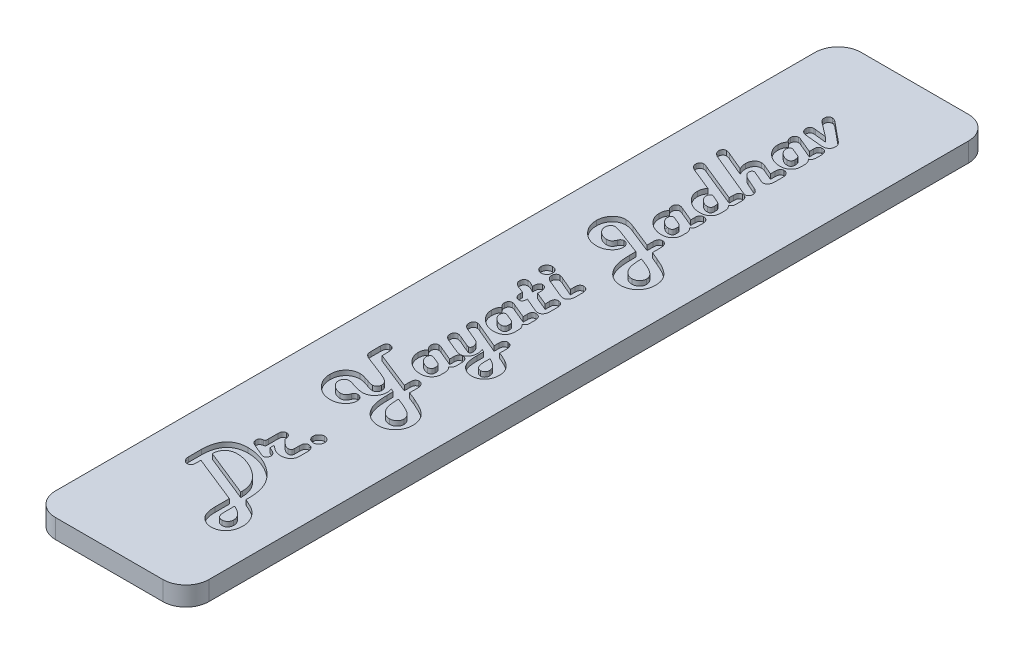
from build123d import *

# Parameters (mm, degrees)
BOSS_EXTRUDE1_DEPTH      = 66.675
BOSS_EXTRUDE1_DEPTH_BACK = 66.675
SKETCH3_W                = 25.4
SKETCH3_H                = 3.175
SKETCH5_OUTSIDE_W        = 54.556
SKETCH5_OUTSIDE_H        = 162.506
CUT_EXTRUDE2_DEPTH       = 68.947967225
CUT_EXTRUDE1_DEPTH       = 0.79375


with BuildPart() as part:
    # Sketch3 → Boss-Extrude1 (new, two sides: drawn at the far end of the back side and taken through both)
    with BuildSketch(Plane.XY.offset(-BOSS_EXTRUDE1_DEPTH_BACK)):
        Rectangle(SKETCH3_W, SKETCH3_H)
    extrude(amount=BOSS_EXTRUDE1_DEPTH + BOSS_EXTRUDE1_DEPTH_BACK)

    # Sketch5 outside → Cut-Extrude2 (cut, through all)
    with BuildSketch(Plane(origin=(0, 1.5875, 0), x_dir=(1, 0, 0), z_dir=(0, 1, 0))):
        Rectangle(SKETCH5_OUTSIDE_W, SKETCH5_OUTSIDE_H)
        with BuildLine():
            Line((12.7, -62.865), (12.7, 62.865))
            ThreePointArc((12.7, 62.865), (11.584076836, 65.559076836), (8.89, 66.675))
            Line((8.89, 66.675), (-8.89, 66.675))
            ThreePointArc((-8.89, 66.675), (-11.584076836, 65.559076836), (-12.7, 62.865))
            Line((-12.7, 62.865), (-12.7, -62.865))
            ThreePointArc((-12.7, -62.865), (-11.584076836, -65.559076836), (-8.89, -66.675))
            Line((-8.89, -66.675), (8.89, -66.675))
            ThreePointArc((8.89, -66.675), (11.584076836, -65.559076836), (12.7, -62.865))
        make_face(mode=Mode.SUBTRACT)
    extrude(amount=-CUT_EXTRUDE2_DEPTH, mode=Mode.SUBTRACT)

    # Sketch4 → Cut-Extrude1 (cut)
    # profile 1 of 16: a face of its own
    with BuildSketch(Plane(origin=(0, 1.5875, 0), x_dir=(1, 0, 0), z_dir=(0, 1, 0))):
        with BuildLine():
            Line((-5.059408711, -46.431595622), (-5.059408711, -47.092585859))
            Line((-5.059408711, -47.092585859), (-5.059408711, -47.272676013))
            add(Edge.make_bspline(
                [(-5.059408711, -47.272676013), (-5.061221798, -47.334795811), (-5.064618151, -47.451161348), (-5.091535017, -47.614088239), (-5.138308522, -47.753478414), (-5.205847499, -47.868694185), (-5.29318842, -47.960108675), (-5.402611201, -48.022244924), (-5.529823431, -48.060922295), (-5.621149297, -48.064426288), (-5.668944619, -48.0662601)],
                knots=[0, 0, 0, 0, 1.305737749, 2.445965353, 3.459324035, 4.379959175, 5.233349143, 6.085046436, 6.997810513, 8, 8, 8, 8], degree=3))
            add(Edge.make_bspline(
                [(-5.668944619, -48.0662601), (-5.731410963, -48.062546922), (-5.854689489, -48.055218893), (-6.031538734, -47.993707442), (-6.188487424, -47.888546667), (-6.326529965, -47.750087851), (-6.43823444, -47.582115593), (-6.52045023, -47.39260496), (-6.571281185, -47.184941247), (-6.576577835, -47.040105188), (-6.579290454, -46.965929047)],
                knots=[0, 0, 0, 0, 0.941902933, 1.858863449, 2.78744378, 3.773831386, 4.79357467, 5.815409039, 6.881186575, 8, 8, 8, 8], degree=3))
            Line((-6.579290454, -46.965929047), (-6.579290454, -46.785838893))
            Line((-6.579290454, -46.785838893), (-6.579290454, -44.828595347))
            add(Edge.make_bspline(
                [(-6.579290454, -44.828595347), (-6.576943694, -44.667531878), (-6.572385212, -44.354672869), (-6.528259255, -43.900229033), (-6.455923195, -43.474599963), (-6.353403231, -43.077915137), (-6.222361398, -42.709653325), (-6.065195062, -42.368423591), (-5.873740924, -42.058623055), (-5.655147073, -41.777517053), (-5.409385454, -41.52700494), (-5.136212127, -41.309715181), (-4.837107727, -41.126358167), (-4.511691276, -40.978002759), (-4.161606554, -40.860600838), (-3.786051006, -40.778758049), (-3.385240043, -40.728017452), (-3.109580017, -40.722834606), (-2.967592303, -40.720165012)],
                knots=[0, 0, 0, 0, 1.240121913, 2.408884614, 3.512215636, 4.562072732, 5.559962685, 6.519078054, 7.449661058, 8.358196616, 9.256317547, 10.145746268, 11.039719344, 11.951275398, 12.894325228, 13.877939151, 14.906963136, 16, 16, 16, 16], degree=3))
            add(Edge.make_bspline(
                [(-2.967592303, -40.720165012), (-2.747632965, -40.72521095), (-2.310664622, -40.735235145), (-1.662489052, -40.824378424), (-1.027874436, -40.96375207), (-0.407611195, -41.161408974), (0.198811118, -41.413293546), (0.789320154, -41.724790775), (1.369088674, -42.088193739), (1.733562556, -42.371372193), (1.918590017, -42.515129518)],
                knots=[0, 0, 0, 0, 0.99369571, 1.974062893, 2.951324249, 3.9272385, 4.912259598, 5.915104549, 6.941589699, 8, 8, 8, 8], degree=3))
            add(Edge.make_bspline(
                [(1.918590017, -42.515129518), (2.020560173, -42.599700079), (2.222042332, -42.766802494), (2.502478713, -43.034951267), (2.761785373, -43.309993398), (3.001726314, -43.592339687), (3.218070421, -43.884602225), (3.415328046, -44.184009965), (3.590018042, -44.492328406), (3.745118814, -44.810044364), (3.880396655, -45.139784806), (3.994887367, -45.484719326), (4.093794803, -45.844617561), (4.175487687, -46.221051111), (4.23491649, -46.61324034), (4.281986789, -47.020374684), (4.30655769, -47.443887739), (4.310957064, -47.731780543), (4.313195366, -47.878253895)],
                knots=[0, 0, 0, 0, 1.041972891, 2.058827374, 3.050103684, 4.014970579, 4.971989252, 5.909071109, 6.834104011, 7.757898592, 8.688895906, 9.635856426, 10.615406742, 11.624176682, 12.664286734, 13.734882699, 14.847559518, 16, 16, 16, 16], degree=3))
            Line((4.313195366, -47.878253895), (4.313195366, -48.349258914))
            Line((4.313195366, -48.349258914), (4.503180584, -48.430398434))
            add(Edge.make_bspline(
                [(4.503180584, -48.430398434), (4.588259484, -48.468697173), (4.751944871, -48.542381057), (4.988574197, -48.64816003), (5.203261613, -48.751971466), (5.399799285, -48.846366139), (5.57612167, -48.935158016), (5.731865259, -49.018766829), (5.86982203, -49.092915253), (6.025786476, -49.188794893), (6.206950257, -49.312831979), (6.417873247, -49.475011687), (6.623701124, -49.659456665), (6.754138311, -49.794427372), (6.820604438, -49.863203618)],
                knots=[0, 0, 0, 0, 1.222800361, 2.352575644, 3.396669397, 4.347862466, 5.210067408, 5.983579217, 6.664594993, 7.262130753, 8.381971782, 9.540587582, 10.746771362, 12, 12, 12, 12], degree=3))
            add(Edge.make_bspline(
                [(6.820604438, -49.863203618), (6.903395523, -49.956833789), (7.066380389, -50.141156786), (7.279287512, -50.437549394), (7.457034343, -50.745255104), (7.606030251, -51.061556068), (7.718433696, -51.389730358), (7.79973761, -51.728240737), (7.851106905, -52.076804434), (7.856747037, -52.313045787), (7.859586098, -52.431962084)],
                knots=[0, 0, 0, 0, 1.055914228, 2.078702545, 3.078046045, 4.055880218, 5.029205391, 6.004237832, 6.995397536, 8, 8, 8, 8], degree=3))
            add(Edge.make_bspline(
                [(7.859586098, -52.431962084), (7.856993501, -52.52900346), (7.851900251, -52.719644769), (7.821168372, -52.998747948), (7.764910307, -53.26414979), (7.687736712, -53.516626362), (7.588871721, -53.756788857), (7.467595534, -53.983571969), (7.324365245, -54.196402518), (7.160327756, -54.393713356), (6.979513426, -54.572824339), (6.785634375, -54.730033175), (6.578828947, -54.861936708), (6.361294215, -54.971957569), (6.129376676, -55.054146169), (5.887288606, -55.116666427), (5.632282094, -55.152367134), (5.458491616, -55.156789472), (5.36998814, -55.159041564)],
                knots=[0, 0, 0, 0, 1.126201464, 2.212463691, 3.25287726, 4.269850786, 5.272053028, 6.261782411, 7.249022054, 8.243830034, 9.23438794, 10.19795826, 11.134388982, 12.075812372, 13.02018767, 13.98375799, 14.973220915, 16, 16, 16, 16], degree=3))
            add(Edge.make_bspline(
                [(5.36998814, -55.159041564), (5.260123428, -55.155766729), (5.042463326, -55.14927874), (4.72333067, -55.081089884), (4.412900993, -54.981590664), (4.118355841, -54.83640341), (3.843725439, -54.657798205), (3.599045642, -54.44668885), (3.384255638, -54.206619671), (3.27040787, -54.025552065), (3.212864313, -53.934032712)],
                knots=[0, 0, 0, 0, 1.014242392, 2.009381349, 3.004557683, 4.021967388, 5.035219112, 6.025505851, 7.00200576, 8, 8, 8, 8], degree=3))
            add(Edge.make_bspline(
                [(3.212864313, -53.934032712), (3.178694237, -53.870618753), (3.108996627, -53.741271623), (3.024864607, -53.532025216), (2.954172904, -53.307460044), (2.894059757, -53.067085806), (2.850150029, -52.810247862), (2.815849805, -52.537620567), (2.796144893, -52.248867799), (2.794273346, -52.050701758), (2.793313624, -51.949082989)],
                knots=[0, 0, 0, 0, 0.84245226, 1.718372183, 2.633912599, 3.596293803, 4.615457363, 5.681185209, 6.810920853, 8, 8, 8, 8], degree=3))
            Line((2.793313624, -51.949082989), (2.793313624, -49.578225792))
            Line((2.793313624, -49.578225792), (-5.059408711, -46.431595622))
        make_face()
        with BuildLine():
            Line((2.793313624, -47.700142753), (2.793313624, -47.432976041))
            add(Edge.make_bspline(
                [(2.793313624, -47.432976041), (2.791702408, -47.347168851), (2.788512013, -47.17726059), (2.765744949, -46.924909875), (2.731199038, -46.677475121), (2.679029552, -46.435775791), (2.613727287, -46.199845695), (2.534611676, -45.968800912), (2.438580345, -45.743429947), (2.331215749, -45.521442131), (2.204488928, -45.307354779), (2.066703887, -45.097274889), (1.912916822, -44.893369527), (1.748048442, -44.692482071), (1.563156135, -44.501289741), (1.36913731, -44.310169423), (1.155852095, -44.128609543), (1.006709699, -44.01267519), (0.931062687, -43.95387174)],
                knots=[0, 0, 0, 0, 1.003752549, 1.98754731, 2.96218803, 3.924869515, 4.877913061, 5.824875223, 6.779479857, 7.742439712, 8.707376773, 9.687714611, 10.680189018, 11.694008127, 12.725763052, 13.790025714, 14.879071578, 16, 16, 16, 16], degree=3))
            add(Edge.make_bspline(
                [(0.931062687, -43.95387174), (0.78095443, -43.844599657), (0.481506127, -43.626614714), (0.004268718, -43.343232886), (-0.489791834, -43.092067538), (-0.997698155, -42.881245585), (-1.503867768, -42.709550944), (-1.997313923, -42.58544917), (-2.471672235, -42.507715826), (-2.782613813, -42.498059912), (-2.933949087, -42.493360378)],
                knots=[0, 0, 0, 0, 1.061151743, 2.116872814, 3.169496409, 4.227969904, 5.258553914, 6.222792805, 7.135033211, 8, 8, 8, 8], degree=3))
            add(Edge.make_bspline(
                [(-2.933949087, -42.493360378), (-3.013845359, -42.49464861), (-3.170118018, -42.497168318), (-3.398491181, -42.52364893), (-3.614094748, -42.565915138), (-3.815738777, -42.628501163), (-4.005154858, -42.7053502), (-4.182086066, -42.800314395), (-4.344678265, -42.914022809), (-4.494222588, -43.042513883), (-4.625964823, -43.18792728), (-4.744719615, -43.344008113), (-4.840786984, -43.51538378), (-4.920660454, -43.697718008), (-4.985190639, -43.89213924), (-5.026231366, -44.100333545), (-5.056449288, -44.319770421), (-5.058404564, -44.470280145), (-5.059408711, -44.547575546)],
                knots=[0, 0, 0, 0, 1.145531499, 2.240595844, 3.292755274, 4.292422607, 5.264114043, 6.220902991, 7.165828125, 8.104908158, 9.042461542, 9.975419986, 10.911970153, 11.852526766, 12.827988561, 13.843075609, 14.892295267, 16, 16, 16, 16], degree=3))
            Line((-5.059408711, -44.547575546), (2.793313624, -47.700142753))
        make_face(mode=Mode.SUBTRACT)
        with BuildLine():
            Line((4.313195366, -50.22536294), (4.313195366, -51.996579293))
            add(Edge.make_bspline(
                [(4.313195366, -51.996579293), (4.31614167, -52.095712577), (4.321654732, -52.281208667), (4.364073868, -52.540796035), (4.436805351, -52.762495523), (4.546252795, -52.94338155), (4.683522298, -53.088394416), (4.85579496, -53.188739111), (5.057259646, -53.249556958), (5.201313756, -53.255872373), (5.276974544, -53.259189386)],
                knots=[0, 0, 0, 0, 1.31364871, 2.458071474, 3.475829816, 4.38621616, 5.23967168, 6.094559773, 6.99921559, 8, 8, 8, 8], degree=3))
            add(Edge.make_bspline(
                [(5.276974544, -53.259189386), (5.340740764, -53.256037014), (5.46538183, -53.249875209), (5.642954311, -53.193348193), (5.806069188, -53.105259998), (5.945616014, -52.9792744), (6.065652646, -52.832443583), (6.151671976, -52.663845941), (6.2026179, -52.479080429), (6.209511273, -52.351145318), (6.213047544, -52.285515145)],
                knots=[0, 0, 0, 0, 1.015443884, 1.984844108, 2.946375274, 3.953924431, 4.965428653, 5.959234333, 6.953095811, 8, 8, 8, 8], degree=3))
            add(Edge.make_bspline(
                [(6.213047544, -52.285515145), (6.211514639, -52.235293124), (6.208451875, -52.134948898), (6.183926181, -51.985587545), (6.143090171, -51.838394756), (6.091088734, -51.691406043), (6.0182553, -51.548290238), (5.929850705, -51.407875808), (5.830080079, -51.266131253), (5.667591001, -51.083116792), (5.43470557, -50.860730618), (5.106825033, -50.621649822), (4.730688138, -50.404357544), (4.455753033, -50.286482688), (4.313195366, -50.22536294)],
                knots=[0, 0, 0, 0, 0.609246736, 1.21728261, 1.830931323, 2.461525313, 3.105941494, 3.774613737, 4.474427454, 5.206422339, 6.740961797, 8.372497183, 10.119089455, 12, 12, 12, 12], degree=3))
        make_face(mode=Mode.SUBTRACT)
    # profile 2 of 16: a face of its own
    with BuildSketch(Plane(origin=(0, 1.5875, 0), x_dir=(1, 0, 0), z_dir=(0, 1, 0))):
        with BuildLine():
            Line((-1.133047544, -38.929158532), (-0.590798068, -39.164661042))
            add(Edge.make_bspline(
                [(-0.590798068, -39.164661042), (-0.533457734, -39.19121397), (-0.424228786, -39.241795265), (-0.277391243, -39.332150205), (-0.150092315, -39.424607609), (-0.046402559, -39.525615912), (0.034874377, -39.633402818), (0.090963623, -39.748414238), (0.126477166, -39.869080309), (0.131161299, -39.952068415), (0.133520575, -39.993867357)],
                knots=[0, 0, 0, 0, 1.297501196, 2.471640463, 3.537215363, 4.524637192, 5.43567625, 6.296618738, 7.14205136, 8, 8, 8, 8], degree=3))
            add(Edge.make_bspline(
                [(0.133520575, -39.993867357), (0.132124839, -40.043580887), (0.129409557, -40.140294223), (0.093846564, -40.277777219), (0.040725262, -40.404312275), (-0.036730962, -40.512904136), (-0.126767084, -40.605634148), (-0.231464824, -40.672800026), (-0.348059997, -40.711669782), (-0.428897175, -40.717297876), (-0.470078294, -40.720165012)],
                knots=[0, 0, 0, 0, 1.131994738, 2.202197021, 3.220602635, 4.248319073, 5.22801886, 6.155513921, 7.060358075, 8, 8, 8, 8], degree=3))
            add(Edge.make_bspline(
                [(-0.470078294, -40.720165012), (-0.499218044, -40.71758365), (-0.566980404, -40.711580879), (-0.679647346, -40.681436162), (-0.816933777, -40.63232131), (-0.916176579, -40.591961406), (-0.970768504, -40.569760048)],
                knots=[0, 0, 0, 0, 0.667539348, 1.552314029, 2.65356594, 4, 4, 4, 4], degree=3))
            Line((-0.970768504, -40.569760048), (-2.763753997, -39.799924114))
            add(Edge.make_bspline(
                [(-2.763753997, -39.799924114), (-2.815170125, -39.776706263), (-2.913349865, -39.732371486), (-3.045413745, -39.649487601), (-3.158743629, -39.561701469), (-3.251729515, -39.465303286), (-3.324450011, -39.362174756), (-3.374003716, -39.250321133), (-3.408159145, -39.132370007), (-3.41128251, -39.050125163), (-3.412870157, -39.00831904)],
                knots=[0, 0, 0, 0, 1.242093141, 2.371792344, 3.427691145, 4.394328043, 5.313892613, 6.192305435, 7.081125362, 8, 8, 8, 8], degree=3))
            add(Edge.make_bspline(
                [(-3.412870157, -39.00831904), (-3.411163979, -38.968003005), (-3.407925024, -38.891468348), (-3.388612461, -38.78169966), (-3.353327552, -38.684386937), (-3.302774108, -38.599300223), (-3.238231802, -38.525906971), (-3.157775444, -38.467366805), (-3.064804408, -38.417873353), (-2.995783937, -38.397544162), (-2.959676252, -38.386909056)],
                knots=[0, 0, 0, 0, 1.15314347, 2.189090296, 3.173792814, 4.095790583, 5.004376053, 5.947550008, 6.926271946, 8, 8, 8, 8], degree=3))
            Line((-2.959676252, -38.386909056), (-2.759795971, -38.331496701))
            add(Edge.make_bspline(
                [(-2.759795971, -38.331496701), (-2.735748973, -38.325084866), (-2.691703864, -38.313340781), (-2.634585283, -38.285163727), (-2.59151934, -38.252159982), (-2.560947532, -38.207631544), (-2.544747313, -38.145040836), (-2.534309592, -38.058094367), (-2.526479032, -37.942406083), (-2.526345982, -37.855224822), (-2.526272474, -37.80705834)],
                knots=[0, 0, 0, 0, 0.926850573, 1.697643703, 2.362895762, 2.92973869, 3.677374781, 4.746381598, 6.202419277, 8, 8, 8, 8], degree=3))
            Line((-2.526272474, -37.80705834), (-2.526272474, -36.243638318))
            add(Edge.make_bspline(
                [(-2.526272474, -36.243638318), (-2.524532467, -36.177554358), (-2.521278246, -36.053961908), (-2.493558114, -35.880957469), (-2.449642601, -35.733404636), (-2.386772452, -35.610223341), (-2.300876341, -35.515897193), (-2.196591421, -35.448639213), (-2.07396949, -35.407873212), (-1.986325506, -35.403083892), (-1.940484719, -35.400578914)],
                knots=[0, 0, 0, 0, 1.361355543, 2.546053047, 3.599677592, 4.524244374, 5.371169927, 6.197098625, 7.057021238, 8, 8, 8, 8], degree=3))
            add(Edge.make_bspline(
                [(-1.940484719, -35.400578914), (-1.876704344, -35.402824793), (-1.755337885, -35.407098432), (-1.587019418, -35.46087092), (-1.441985775, -35.544998924), (-1.327816684, -35.669236589), (-1.236574655, -35.823930279), (-1.175701967, -36.01297695), (-1.138009761, -36.234213217), (-1.134775851, -36.39254446), (-1.133047544, -36.477161815)],
                knots=[0, 0, 0, 0, 0.994284648, 1.892005291, 2.734571892, 3.588753721, 4.500369607, 5.525254763, 6.677415825, 8, 8, 8, 8], degree=3))
            Line((-1.133047544, -36.477161815), (-1.067740125, -36.546427259))
            add(Edge.make_bspline(
                [(-1.067740125, -36.546427259), (-0.987921256, -36.625613548), (-0.835136029, -36.777187921), (-0.60704457, -36.982462202), (-0.391993659, -37.155724293), (-0.193594409, -37.300099195), (-0.006185567, -37.410048128), (0.165468107, -37.490304666), (0.324390219, -37.543151852), (0.42739902, -37.550354238), (0.475889769, -37.553744716)],
                knots=[0, 0, 0, 0, 1.435762249, 2.748263184, 3.91660617, 4.961556361, 5.879059361, 6.685751502, 7.381325737, 8, 8, 8, 8], degree=3))
            add(Edge.make_bspline(
                [(0.475889769, -37.553744716), (0.518360985, -37.552905353), (0.59906364, -37.551310419), (0.710559399, -37.521159043), (0.809251217, -37.482498036), (0.88615109, -37.417403528), (0.948196196, -37.337709558), (0.990380475, -37.239662736), (1.017109736, -37.125051008), (1.019069792, -37.043333288), (1.020118258, -36.999621164)],
                knots=[0, 0, 0, 0, 1.140484469, 2.167117703, 3.098941929, 3.971150526, 4.846255631, 5.80154673, 6.824011975, 8, 8, 8, 8], degree=3))
            Line((1.020118258, -36.999621164), (1.020118258, -36.15656176))
            add(Edge.make_bspline(
                [(1.020118258, -36.15656176), (1.021984217, -36.087220387), (1.025466972, -35.957796836), (1.051533923, -35.776091401), (1.100887158, -35.622437257), (1.167116652, -35.494377542), (1.255478016, -35.394789329), (1.363636668, -35.323386319), (1.492717348, -35.280695043), (1.585120442, -35.276253144), (1.63361219, -35.273922102)],
                knots=[0, 0, 0, 0, 1.364190584, 2.546219988, 3.596843527, 4.525897283, 5.362221888, 6.186477391, 7.048290713, 8, 8, 8, 8], degree=3))
            add(Edge.make_bspline(
                [(1.63361219, -35.273922102), (1.70200856, -35.277504661), (1.833530254, -35.284393684), (2.018290659, -35.343278217), (2.178749377, -35.441037996), (2.309797916, -35.579625186), (2.41659376, -35.749968703), (2.487295379, -35.954331576), (2.534438198, -36.186068773), (2.538083095, -36.350896304), (2.54, -36.437581561)],
                knots=[0, 0, 0, 0, 0.982615473, 1.889504555, 2.759142238, 3.658944971, 4.610088785, 5.631441668, 6.75433984, 8, 8, 8, 8], degree=3))
            Line((2.54, -36.437581561), (2.54, -37.747687959))
            add(Edge.make_bspline(
                [(2.54, -37.747687959), (2.538430408, -37.799888069), (2.535356682, -37.902111343), (2.512617758, -38.05184553), (2.478022786, -38.194981864), (2.425832595, -38.330150311), (2.359635976, -38.457854869), (2.280705326, -38.579632687), (2.184687895, -38.692264981), (2.076052454, -38.797127915), (1.955607585, -38.891255962), (1.827028716, -38.975191189), (1.68869591, -39.044657477), (1.5424848, -39.102308325), (1.386467302, -39.145654631), (1.222288609, -39.176736048), (1.049676112, -39.197598079), (0.931785098, -39.199376667), (0.871692306, -39.20028327)],
                knots=[0, 0, 0, 0, 1.009407673, 1.976719137, 2.923785669, 3.852797958, 4.771676065, 5.702527031, 6.65345443, 7.628144937, 8.618662201, 9.606215811, 10.593522047, 11.607757909, 12.641947342, 13.720607507, 14.838121302, 16, 16, 16, 16], degree=3))
            add(Edge.make_bspline(
                [(0.871692306, -39.20028327), (0.793683688, -39.197476521), (0.637343317, -39.191851396), (0.405084974, -39.150543761), (0.175746401, -39.085544219), (-0.053629714, -38.989140218), (-0.292447526, -38.857576405), (-0.551427767, -38.687679885), (-0.835914279, -38.477113779), (-1.030170108, -38.318517369), (-1.133047544, -38.23452508)],
                knots=[0, 0, 0, 0, 0.822710096, 1.64882809, 2.481516469, 3.333299355, 4.267584386, 5.354441073, 6.598918144, 8, 8, 8, 8], degree=3))
            Line((-1.133047544, -38.23452508), (-1.133047544, -38.929158532))
        make_face()
    # profile 3 of 16: a face of its own
    with BuildSketch(Plane(origin=(0, 1.5875, 0), x_dir=(1, 0, 0), z_dir=(0, 1, 0))):
        with BuildLine():
            add(Edge.make_bspline(
                [(0.766804634, -33.686753929), (0.770139014, -33.623697926), (0.776646221, -33.500641), (0.830830714, -33.323288079), (0.91939683, -33.160164259), (1.042292932, -33.016274163), (1.186183028, -32.893378061), (1.349306847, -32.804811945), (1.526659768, -32.750627452), (1.649716695, -32.744120245), (1.712772698, -32.740785865)],
                knots=[0, 0, 0, 0, 1.018015329, 1.986707578, 2.970091954, 4, 5.029908046, 6.013292422, 6.981984671, 8, 8, 8, 8], degree=3))
            add(Edge.make_bspline(
                [(1.712772698, -32.740785865), (1.776467102, -32.744194743), (1.901411116, -32.750881656), (2.081524984, -32.80440233), (2.246960005, -32.892801573), (2.391134327, -33.016327954), (2.514073317, -33.160150569), (2.602628499, -33.323291593), (2.656815813, -33.500640075), (2.663322631, -33.623697613), (2.666656812, -33.686753929)],
                knots=[0, 0, 0, 0, 1.023458974, 2.007634331, 2.995409192, 4.02013336, 5.044857529, 6.023292197, 6.987108688, 8, 8, 8, 8], degree=3))
            add(Edge.make_bspline(
                [(2.666656812, -33.686753929), (2.663248136, -33.750448652), (2.656561621, -33.875393291), (2.603038054, -34.055502606), (2.514649886, -34.22095506), (2.391080568, -34.365061799), (2.246973829, -34.488631118), (2.081521375, -34.577019285), (1.901412059, -34.630542852), (1.77646742, -34.637229367), (1.712772698, -34.640638043)],
                knots=[0, 0, 0, 0, 1.018333356, 1.997579833, 2.980407786, 4, 5.019592214, 6.002420167, 6.981666644, 8, 8, 8, 8], degree=3))
            add(Edge.make_bspline(
                [(1.712772698, -34.640638043), (1.649716382, -34.637303863), (1.526658843, -34.630797044), (1.349310361, -34.57660973), (1.186169337, -34.488054549), (1.042346723, -34.365115558), (0.918820342, -34.220941237), (0.830421099, -34.055506215), (0.776900424, -33.875392348), (0.770213512, -33.750448333), (0.766804634, -33.686753929)],
                knots=[0, 0, 0, 0, 1.012891312, 1.976707803, 2.955142471, 3.97986664, 5.004590808, 5.992365669, 6.976541026, 8, 8, 8, 8], degree=3))
        make_face()
    # profile 4 of 16: a face of its own
    with BuildSketch(Plane(origin=(0, 1.5875, 0), x_dir=(1, 0, 0), z_dir=(0, 1, 0))):
        with BuildLine():
            Line((-5.059408711, -16.437679364), (1.020118258, -18.842179777))
            Line((1.020118258, -18.842179777), (1.020118258, -17.939749992))
            add(Edge.make_bspline(
                [(1.020118258, -17.939749992), (1.021701083, -17.869028298), (1.024675896, -17.736111679), (1.05440501, -17.551353369), (1.100271709, -17.392379914), (1.169530862, -17.262185483), (1.258084646, -17.157925115), (1.370237329, -17.087402592), (1.500198417, -17.041436463), (1.594268218, -17.037435449), (1.643507254, -17.035341195)],
                knots=[0, 0, 0, 0, 1.360835868, 2.557598547, 3.594375751, 4.532254242, 5.378397881, 6.195922688, 7.055690267, 8, 8, 8, 8], degree=3))
            add(Edge.make_bspline(
                [(1.643507254, -17.035341195), (1.709933168, -17.038860992), (1.838436803, -17.045670183), (2.020387087, -17.106670335), (2.177126269, -17.21176391), (2.308881847, -17.355327289), (2.413353785, -17.533613565), (2.489311205, -17.743992446), (2.530978096, -17.986278942), (2.536884879, -18.157943478), (2.54, -18.248475971)],
                knots=[0, 0, 0, 0, 0.936786274, 1.812251183, 2.673154433, 3.576750736, 4.542311685, 5.574419502, 6.720796659, 8, 8, 8, 8], degree=3))
            Line((2.54, -18.248475971), (2.54, -19.497232975))
            Line((2.54, -19.497232975), (3.768966878, -19.986049109))
            add(Edge.make_bspline(
                [(3.768966878, -19.986049109), (3.93298895, -20.053655165), (4.249856611, -20.184260592), (4.703307841, -20.390264374), (5.1179253, -20.600067186), (5.497886698, -20.808583077), (5.838573213, -21.02240174), (6.142603601, -21.237621546), (6.409085189, -21.455181772), (6.640540511, -21.676684861), (6.838896338, -21.908056862), (7.0124311, -22.148307148), (7.15549143, -22.405512455), (7.2750999, -22.673968758), (7.36555487, -22.95837944), (7.434106639, -23.254570476), (7.470782352, -23.565824761), (7.476634699, -23.777092374), (7.479615662, -23.884704099)],
                knots=[0, 0, 0, 0, 1.474656589, 2.848829899, 4.138758191, 5.33659665, 6.45028361, 7.480402892, 8.431067395, 9.307509313, 10.139600529, 10.961273262, 11.766589812, 12.581704122, 13.400205247, 14.243602812, 15.105357764, 16, 16, 16, 16], degree=3))
            add(Edge.make_bspline(
                [(7.479615662, -23.884704099), (7.47781993, -23.986446514), (7.474295609, -24.186127126), (7.432156361, -24.4786432), (7.370180438, -24.758633843), (7.28073095, -25.026317478), (7.163119806, -25.279608486), (7.021684754, -25.521121044), (6.854955227, -25.749531312), (6.663612997, -25.961217983), (6.45524066, -26.155221654), (6.23069973, -26.323758051), (5.993758667, -26.467807587), (5.743392229, -26.584640455), (5.480779391, -26.675956068), (5.205831308, -26.74201053), (4.917812218, -26.779154611), (4.721634026, -26.784963294), (4.621921345, -26.787915708)],
                knots=[0, 0, 0, 0, 1.071987516, 2.103892691, 3.109584056, 4.092798489, 5.073154735, 6.048984922, 7.039552976, 8.049277301, 9.053403949, 10.036938179, 11.004378095, 11.972118024, 12.944421671, 13.931368787, 14.948564255, 16, 16, 16, 16], degree=3))
            add(Edge.make_bspline(
                [(4.621921345, -26.787915708), (4.545988337, -26.78646627), (4.395068707, -26.783585459), (4.171089362, -26.758252787), (3.951266007, -26.721809426), (3.736366256, -26.667688834), (3.525987792, -26.598364141), (3.320618664, -26.512994859), (3.119362932, -26.413648006), (2.92430934, -26.299191366), (2.735733031, -26.170367279), (2.556092201, -26.027226789), (2.382809178, -25.873365007), (2.221111062, -25.703882439), (2.06622777, -25.524250301), (1.921371693, -25.330838003), (1.784672058, -25.125271038), (1.701442213, -24.980890406), (1.659339355, -24.907853657)],
                knots=[0, 0, 0, 0, 0.987626446, 1.962943669, 2.929497824, 3.884975496, 4.84307092, 5.808977033, 6.776254957, 7.761042961, 8.749004998, 9.744950321, 10.7478243, 11.761511249, 12.790202706, 13.832164018, 14.903373055, 16, 16, 16, 16], degree=3))
            add(Edge.make_bspline(
                [(1.659339355, -24.907853657), (1.608582383, -24.80911763), (1.504124751, -24.60591931), (1.381158292, -24.275649698), (1.27030407, -23.920870651), (1.185709439, -23.537126223), (1.115270433, -23.127887595), (1.070018368, -22.690179307), (1.03908246, -22.226079258), (1.035704329, -21.907066206), (1.033971347, -21.743412373)],
                knots=[0, 0, 0, 0, 0.817265932, 1.681929795, 2.592031324, 3.554101286, 4.574424961, 5.649994232, 6.794446028, 8, 8, 8, 8], degree=3))
            Line((1.033971347, -21.743412373), (1.020118258, -20.678703548))
            Line((1.020118258, -20.678703548), (0.460057668, -20.45111709))
            add(Edge.make_bspline(
                [(0.460057668, -20.45111709), (0.488138948, -20.509821326), (0.544185469, -20.626987217), (0.598275222, -20.816054592), (0.633325057, -21.013161916), (0.637846141, -21.148231257), (0.640147822, -21.216994999)],
                knots=[0, 0, 0, 0, 0.981959291, 1.959860882, 2.961366062, 4, 4, 4, 4], degree=3))
            add(Edge.make_bspline(
                [(0.640147822, -21.216994999), (0.638213999, -21.292948227), (0.634433934, -21.441414781), (0.605734723, -21.659264488), (0.560613284, -21.867313908), (0.497514769, -22.066625963), (0.414215666, -22.254915948), (0.311640022, -22.432529113), (0.193072435, -22.601944336), (0.055240684, -22.757959447), (-0.094961041, -22.901386722), (-0.25701839, -23.025875344), (-0.428550622, -23.131059147), (-0.608011366, -23.220001673), (-0.798869851, -23.286888307), (-0.999207152, -23.334191377), (-1.208775228, -23.36227315), (-1.351313115, -23.366186974), (-1.423962409, -23.368181788)],
                knots=[0, 0, 0, 0, 1.09284127, 2.136188053, 3.156693506, 4.153518113, 5.139660769, 6.113524735, 7.101311268, 8.110537127, 9.104463982, 10.08620951, 11.045291317, 11.996398528, 12.963295949, 13.948890037, 14.954581884, 16, 16, 16, 16], degree=3))
            add(Edge.make_bspline(
                [(-1.423962409, -23.368181788), (-1.464887141, -23.367336216), (-1.551505243, -23.365546544), (-1.687508714, -23.352689208), (-1.836924096, -23.333421572), (-1.998722394, -23.301845753), (-2.174923322, -23.268079497), (-2.362802219, -23.22024206), (-2.564876157, -23.170696171), (-2.702560874, -23.129962423), (-2.77364906, -23.108931126)],
                knots=[0, 0, 0, 0, 0.712516655, 1.508057255, 2.377148218, 3.334647914, 4.377620321, 5.500336827, 6.709395478, 8, 8, 8, 8], degree=3))
            Line((-2.77364906, -23.108931126), (-3.17143061, -22.984253327))
            Line((-3.17143061, -22.984253327), (-3.569212159, -22.865512566))
            add(Edge.make_bspline(
                [(-3.569212159, -22.865512566), (-3.636972524, -22.8456988), (-3.765107581, -22.808230908), (-3.95107706, -22.765160358), (-4.120021881, -22.740506394), (-4.227498542, -22.73668338), (-4.277698701, -22.734897728)],
                knots=[0, 0, 0, 0, 1.171740543, 2.215764959, 3.16662016, 4, 4, 4, 4], degree=3))
            add(Edge.make_bspline(
                [(-4.277698701, -22.734897728), (-4.330336796, -22.737353063), (-4.433721431, -22.7421755), (-4.580386174, -22.798660779), (-4.715891849, -22.882837819), (-4.83441139, -23.000415266), (-4.93537517, -23.138752364), (-5.006464824, -23.295917103), (-5.052861871, -23.465809397), (-5.057182742, -23.584234746), (-5.059408711, -23.645243564)],
                knots=[0, 0, 0, 0, 0.944836529, 1.855720244, 2.796652473, 3.806464848, 4.846666757, 5.868881901, 6.902118552, 8, 8, 8, 8], degree=3))
            add(Edge.make_bspline(
                [(-5.059408711, -23.645243564), (-5.057368335, -23.695507346), (-5.053284068, -23.796121483), (-5.024436284, -23.944920324), (-4.979004752, -24.0914985), (-4.912248224, -24.23311148), (-4.831579329, -24.374289265), (-4.726847151, -24.507231439), (-4.607304701, -24.639722508), (-4.470696831, -24.765135752), (-4.324161816, -24.883494536), (-4.170465729, -24.986167909), (-4.012278519, -25.071735573), (-3.852424359, -25.143288792), (-3.688336728, -25.199787586), (-3.520519039, -25.238654292), (-3.348969385, -25.263616693), (-3.233525562, -25.266554501), (-3.175388635, -25.268033966)],
                knots=[0, 0, 0, 0, 0.885041318, 1.771606993, 2.660985842, 3.581328934, 4.523995401, 5.518724548, 6.555201145, 7.665215384, 8.781295319, 9.870619483, 10.915788132, 11.945795875, 12.952667832, 13.967354694, 14.976370075, 16, 16, 16, 16], degree=3))
            add(Edge.make_bspline(
                [(-3.175388635, -25.268033966), (-3.111275397, -25.265664563), (-2.990102844, -25.261186445), (-2.818042972, -25.230312989), (-2.668682337, -25.175133354), (-2.536541004, -25.096642014), (-2.42054436, -24.98701902), (-2.31764767, -24.843593016), (-2.216893328, -24.669979088), (-2.163108132, -24.538579663), (-2.134427963, -24.468512841)],
                knots=[0, 0, 0, 0, 1.081761585, 2.044504654, 2.935603147, 3.754538439, 4.620892086, 5.607093003, 6.724017314, 8, 8, 8, 8], degree=3))
            add(Edge.make_bspline(
                [(-2.134427963, -24.468512841), (-2.119003183, -24.431680649), (-2.089126707, -24.360339853), (-2.028402865, -24.265891751), (-1.963985965, -24.182862616), (-1.889079859, -24.116662766), (-1.807881315, -24.064426752), (-1.717934677, -24.028115903), (-1.620927833, -24.006279017), (-1.553371396, -24.003090318), (-1.518955018, -24.001465847)],
                knots=[0, 0, 0, 0, 1.157131426, 2.24126429, 3.249300519, 4.198870978, 5.128727727, 6.039249794, 7.001103001, 8, 8, 8, 8], degree=3))
            add(Edge.make_bspline(
                [(-1.518955018, -24.001465847), (-1.457180402, -24.004617318), (-1.33707038, -24.010744806), (-1.164862368, -24.067087004), (-1.010935081, -24.159933913), (-0.875959286, -24.285647269), (-0.766686332, -24.437632643), (-0.682589971, -24.608837237), (-0.635092694, -24.799785456), (-0.629361636, -24.932668126), (-0.626420296, -25.000867253)],
                knots=[0, 0, 0, 0, 0.990117672, 1.925112047, 2.875591459, 3.857909445, 4.866845389, 5.866893825, 6.905229857, 8, 8, 8, 8], degree=3))
            add(Edge.make_bspline(
                [(-0.626420296, -25.000867253), (-0.629059733, -25.070218166), (-0.63426553, -25.206999913), (-0.664910715, -25.409057508), (-0.724426183, -25.601298049), (-0.801319742, -25.788022966), (-0.903053239, -25.965159102), (-1.025264782, -26.136554042), (-1.171892463, -26.297224991), (-1.33805813, -26.448804557), (-1.51790464, -26.588457867), (-1.710654488, -26.710115716), (-1.913962444, -26.810032772), (-2.12405331, -26.896851266), (-2.344940898, -26.962103339), (-2.574978196, -27.006678109), (-2.81382732, -27.035431476), (-2.976084367, -27.039274387), (-3.058626887, -27.041229332)],
                knots=[0, 0, 0, 0, 0.944726412, 1.863296746, 2.772729923, 3.678607141, 4.607832478, 5.54763495, 6.539811085, 7.56341005, 8.607303459, 9.636601685, 10.66098864, 11.688521513, 12.728736843, 13.791019513, 14.876259503, 16, 16, 16, 16], degree=3))
            add(Edge.make_bspline(
                [(-3.058626887, -27.041229332), (-3.17888714, -27.037793267), (-3.41656168, -27.031002452), (-3.767109888, -26.97723288), (-4.106804509, -26.893924833), (-4.432907471, -26.769968501), (-4.75026038, -26.619457839), (-5.050889387, -26.425506823), (-5.343968, -26.203976461), (-5.619451586, -25.948638428), (-5.871753441, -25.670710155), (-6.095993036, -25.378502859), (-6.284547026, -25.073583779), (-6.43751894, -24.756044252), (-6.559947516, -24.428660251), (-6.644688177, -24.088770938), (-6.695124434, -23.737134052), (-6.702303497, -23.498962166), (-6.705947266, -23.378076851)],
                knots=[0, 0, 0, 0, 1.008163636, 1.992469029, 2.967996822, 3.936075385, 4.913484017, 5.908121822, 6.930575673, 7.991638385, 9.053047217, 10.075501068, 11.076595985, 12.054004617, 13.027270605, 14.002798398, 14.98631048, 16, 16, 16, 16], degree=3))
            add(Edge.make_bspline(
                [(-6.705947266, -23.378076851), (-6.704289923, -23.288259958), (-6.701037481, -23.111999269), (-6.668189701, -22.853076272), (-6.615878257, -22.605649921), (-6.539557564, -22.370818041), (-6.444768285, -22.14757596), (-6.327324317, -21.936625493), (-6.187726134, -21.738560833), (-6.03057731, -21.552504564), (-5.855061315, -21.385956451), (-5.668178359, -21.237967178), (-5.469670395, -21.112097776), (-5.258508094, -21.011692929), (-5.037533606, -20.930940768), (-4.804871589, -20.87682807), (-4.561754566, -20.841854102), (-4.395904265, -20.837344744), (-4.311341916, -20.835045551)],
                knots=[0, 0, 0, 0, 1.102113289, 2.162836425, 3.198469757, 4.202398062, 5.189195475, 6.171630117, 7.160153979, 8.159761477, 9.15641223, 10.125234664, 11.082377343, 12.034987029, 12.990483836, 13.964740318, 14.962279015, 16, 16, 16, 16], degree=3))
            add(Edge.make_bspline(
                [(-4.311341916, -20.835045551), (-4.229439114, -20.836886951), (-4.065758579, -20.840566939), (-3.823167224, -20.87213319), (-3.582776495, -20.917724144), (-3.427635845, -20.966722801), (-3.349541751, -20.991387553)],
                knots=[0, 0, 0, 0, 1.003992999, 2.006452859, 2.996496046, 4, 4, 4, 4], degree=3))
            Line((-3.349541751, -20.991387553), (-2.623244096, -21.236785126))
            add(Edge.make_bspline(
                [(-2.623244096, -21.236785126), (-2.517943142, -21.271286116), (-2.325473641, -21.334347164), (-2.059291038, -21.408715803), (-1.841949985, -21.457314253), (-1.711744172, -21.465007021), (-1.655506893, -21.46832961)],
                knots=[0, 0, 0, 0, 1.331701076, 2.434088493, 3.323666118, 4, 4, 4, 4], degree=3))
            add(Edge.make_bspline(
                [(-1.655506893, -21.46832961), (-1.603722868, -21.465925906), (-1.501523877, -21.461182046), (-1.355339327, -21.41567669), (-1.220949841, -21.342938084), (-1.104227557, -21.241653129), (-1.005057071, -21.12249777), (-0.933195904, -20.987800449), (-0.886365856, -20.841397039), (-0.881982591, -20.739099521), (-0.87973392, -20.686619599)],
                knots=[0, 0, 0, 0, 1.013748817, 2.000696291, 2.973880279, 3.993233604, 5.014229458, 5.998797103, 6.97335759, 8, 8, 8, 8], degree=3))
            add(Edge.make_bspline(
                [(-0.87973392, -20.686619599), (-0.883744687, -20.609631745), (-0.891609701, -20.458660463), (-0.959126016, -20.241696734), (-1.073559771, -20.046292092), (-1.202421856, -19.901049385), (-1.326811928, -19.791485822), (-1.441269964, -19.711506239), (-1.57006143, -19.628496321), (-1.714139161, -19.542396749), (-1.8775492, -19.461013914), (-2.055127907, -19.375337927), (-2.249289584, -19.290417855), (-2.384943174, -19.236271569), (-2.455028018, -19.208297123)],
                knots=[0, 0, 0, 0, 1.198338302, 2.349911807, 3.501806731, 4.704374164, 5.360320037, 6.0824261, 6.878319105, 7.749642267, 8.697144445, 9.722955198, 10.823574594, 12, 12, 12, 12], degree=3))
            Line((-2.455028018, -19.208297123), (-5.726335986, -17.941729005))
            add(Edge.make_bspline(
                [(-5.726335986, -17.941729005), (-5.800300382, -17.911020166), (-5.93982073, -17.85309354), (-6.126662373, -17.746383654), (-6.276631045, -17.62734784), (-6.39688403, -17.496402489), (-6.482037478, -17.341637278), (-6.537476839, -17.16184511), (-6.573721613, -16.956304695), (-6.577365192, -16.809908037), (-6.579290454, -16.732552254)],
                knots=[0, 0, 0, 0, 1.19555214, 2.255191136, 3.201577125, 4.04604088, 4.893030226, 5.815361084, 6.845639943, 8, 8, 8, 8], degree=3))
            Line((-6.579290454, -16.732552254), (-6.579290454, -15.155279144))
            add(Edge.make_bspline(
                [(-6.579290454, -15.155279144), (-6.577537045, -15.084571116), (-6.574244155, -14.951781871), (-6.546571992, -14.766516719), (-6.50361033, -14.606562053), (-6.435614705, -14.476655596), (-6.351602689, -14.37165745), (-6.243688085, -14.301515156), (-6.119215884, -14.254866727), (-6.028927075, -14.250945498), (-5.981628623, -14.248891334)],
                knots=[0, 0, 0, 0, 1.379990077, 2.59161294, 3.651630049, 4.596669714, 5.437923708, 6.245455362, 7.080868962, 8, 8, 8, 8], degree=3))
            add(Edge.make_bspline(
                [(-5.981628623, -14.248891334), (-5.911891895, -14.252284501), (-5.778175459, -14.258790717), (-5.589368338, -14.320259118), (-5.42685462, -14.423915748), (-5.292446081, -14.568327392), (-5.187605056, -14.74856871), (-5.10991894, -14.960593062), (-5.068538658, -15.205814027), (-5.062560434, -15.378763237), (-5.059408711, -15.469942161)],
                knots=[0, 0, 0, 0, 0.966032839, 1.852316172, 2.721251112, 3.615355715, 4.564083764, 5.598549613, 6.733953968, 8, 8, 8, 8], degree=3))
            Line((-5.059408711, -15.469942161), (-5.059408711, -16.437679364))
        make_face()
        with BuildLine():
            add(Edge.make_bspline(
                [(2.54, -21.327819709), (2.540452615, -21.438666772), (2.541331291, -21.653857725), (2.55686577, -21.966547723), (2.574808654, -22.259126112), (2.604397277, -22.531891858), (2.644436384, -22.783829643), (2.689033394, -23.017377262), (2.743218519, -23.230497186), (2.789165019, -23.36382793), (2.811124738, -23.427552168)],
                knots=[0, 0, 0, 0, 1.250521159, 2.427676782, 3.531759999, 4.55755176, 5.521821916, 6.409325765, 7.239751462, 8, 8, 8, 8], degree=3))
            add(Edge.make_bspline(
                [(2.811124738, -23.427552168), (2.854228682, -23.537213412), (2.937753632, -23.749710205), (3.110743441, -24.03652755), (3.302883182, -24.291442296), (3.52621099, -24.503089167), (3.766287218, -24.675283609), (4.024199375, -24.797814359), (4.29423354, -24.875020808), (4.479590734, -24.883710434), (4.572446028, -24.88806353)],
                knots=[0, 0, 0, 0, 1.157518394, 2.242988848, 3.28431522, 4.289819524, 5.258764801, 6.179201011, 7.087864774, 8, 8, 8, 8], degree=3))
            add(Edge.make_bspline(
                [(4.572446028, -24.88806353), (4.65721729, -24.883673843), (4.823130514, -24.875082404), (5.062182983, -24.813823405), (5.278740615, -24.704980962), (5.471272847, -24.560073349), (5.631035069, -24.38351795), (5.74946892, -24.184190943), (5.819213356, -23.964406545), (5.828397659, -23.811967578), (5.833077108, -23.734299135)],
                knots=[0, 0, 0, 0, 1.070250937, 2.094681364, 3.089415811, 4.112422617, 5.121117109, 6.076963894, 7.020203146, 8, 8, 8, 8], degree=3))
            add(Edge.make_bspline(
                [(5.833077108, -23.734299135), (5.831723018, -23.685371951), (5.829032084, -23.588140714), (5.802082118, -23.443823931), (5.757871659, -23.303556618), (5.699627604, -23.165208464), (5.617328123, -23.035247262), (5.524659958, -22.904211254), (5.411632464, -22.779089535), (5.281216812, -22.656634908), (5.130681171, -22.538577339), (4.963204178, -22.41660466), (4.771464045, -22.299816399), (4.562018646, -22.17711496), (4.328126151, -22.06037329), (4.073836177, -21.941518737), (3.800018406, -21.820362589), (3.608290084, -21.744707774), (3.509716216, -21.705811132)],
                knots=[0, 0, 0, 0, 0.718007452, 1.426870453, 2.147031835, 2.876002857, 3.62372636, 4.400875223, 5.231222159, 6.094872537, 7.025437882, 8.039095782, 9.135927338, 10.320838892, 11.603406625, 12.97304179, 14.44374071, 16, 16, 16, 16], degree=3))
            Line((3.509716216, -21.705811132), (2.54, -21.327819709))
        make_face(mode=Mode.SUBTRACT)
    # profile 5 of 16: a face of its own
    with BuildSketch(Plane(origin=(0, 1.5875, 0), x_dir=(1, 0, 0), z_dir=(0, 1, 0))):
        with BuildLine():
            Line((1.020118258, -11.339742687), (1.020118258, -10.603549968))
            add(Edge.make_bspline(
                [(1.020118258, -10.603549968), (1.022030585, -10.542115408), (1.025630745, -10.42645829), (1.051643367, -10.263675619), (1.101010548, -10.125553333), (1.168396858, -10.01118), (1.256589291, -9.922116059), (1.365212679, -9.859832048), (1.493175549, -9.821075736), (1.585158661, -9.817687647), (1.63361219, -9.815902919)],
                knots=[0, 0, 0, 0, 1.294659495, 2.437334719, 3.457519937, 4.368220716, 5.213556601, 6.067082152, 6.981805575, 8, 8, 8, 8], degree=3))
            add(Edge.make_bspline(
                [(1.63361219, -9.815902919), (1.701266236, -9.819008025), (1.831002227, -9.824962496), (2.014642077, -9.87931252), (2.172462239, -9.972980626), (2.305637414, -10.100413278), (2.40995049, -10.259311943), (2.489629362, -10.444924983), (2.530613014, -10.659856653), (2.536772349, -10.811199329), (2.54, -10.890506807)],
                knots=[0, 0, 0, 0, 1.020499011, 1.956948009, 2.859423251, 3.7687511, 4.716847855, 5.712717295, 6.801404681, 8, 8, 8, 8], degree=3))
            Line((2.54, -10.890506807), (2.54, -11.745440287))
            add(Edge.make_bspline(
                [(2.54, -11.745440287), (2.538441815, -11.791694194), (2.535462365, -11.880137577), (2.513879543, -12.007615726), (2.475293112, -12.122934117), (2.425610674, -12.230068701), (2.353294927, -12.320762873), (2.272096342, -12.404050905), (2.173506491, -12.47423719), (2.099299197, -12.509162243), (2.06107893, -12.527150298)],
                knots=[0, 0, 0, 0, 1.135251448, 2.170745912, 3.158955961, 4.114801062, 5.050690111, 5.989515837, 6.964505536, 8, 8, 8, 8], degree=3))
            add(Edge.make_bspline(
                [(2.06107893, -12.527150298), (2.133810309, -12.607460853), (2.271082801, -12.759038208), (2.423139189, -13.006415149), (2.521558028, -13.251569771), (2.533987947, -13.416900167), (2.54, -13.496866514)],
                knots=[0, 0, 0, 0, 1.172002926, 2.212026842, 3.135200271, 4, 4, 4, 4], degree=3))
            Line((2.54, -13.496866514), (2.54, -14.256807385))
            add(Edge.make_bspline(
                [(2.54, -14.256807385), (2.538569993, -14.316921364), (2.535776775, -14.434341409), (2.51126098, -14.606047888), (2.472087508, -14.768625935), (2.416594304, -14.923125073), (2.342571826, -15.066983385), (2.255069088, -15.204004664), (2.149520553, -15.32966414), (2.030994005, -15.447297918), (1.897774304, -15.551053458), (1.75590598, -15.645241254), (1.601955477, -15.722152007), (1.439009344, -15.785843365), (1.266610844, -15.834727556), (1.084783687, -15.871365534), (0.892528329, -15.889975725), (0.760900247, -15.893584326), (0.693581165, -15.895429888)],
                knots=[0, 0, 0, 0, 1.038806976, 2.029091485, 2.99167023, 3.926069813, 4.859424868, 5.783114847, 6.730782711, 7.690452028, 8.664715101, 9.645298791, 10.629655371, 11.633506053, 12.665844953, 13.723757455, 14.835852066, 16, 16, 16, 16], degree=3))
            add(Edge.make_bspline(
                [(0.693581165, -15.895429888), (0.590524348, -15.892863907), (0.386854996, -15.887792805), (0.085409439, -15.844335688), (-0.207647045, -15.775775371), (-0.492621894, -15.677995966), (-0.768103378, -15.552006657), (-1.037245398, -15.402164198), (-1.294941714, -15.219181001), (-1.543006347, -15.01479613), (-1.771410212, -14.792396974), (-1.973489991, -14.560350849), (-2.142905013, -14.319368332), (-2.28193218, -14.071274903), (-2.392708989, -13.816485638), (-2.470056645, -13.553319321), (-2.516740579, -13.282818861), (-2.523085265, -13.099925577), (-2.526272474, -13.00805038)],
                knots=[0, 0, 0, 0, 1.038436407, 2.05224338, 3.063582843, 4.068804017, 5.083657321, 6.113884954, 7.169134107, 8.264944544, 9.351250422, 10.379092992, 11.362431842, 12.315140492, 13.241586482, 14.156891473, 15.074126981, 16, 16, 16, 16], degree=3))
            add(Edge.make_bspline(
                [(-2.526272474, -13.00805038), (-2.524599435, -12.939403646), (-2.521357125, -12.806367864), (-2.500779324, -12.613194556), (-2.46033774, -12.434598186), (-2.407677152, -12.269865296), (-2.340197419, -12.11918124), (-2.256205945, -11.983700402), (-2.157770241, -11.860911969), (-2.078829362, -11.793122484), (-2.039435354, -11.759293376)],
                knots=[0, 0, 0, 0, 1.187941941, 2.302203992, 3.354530118, 4.350764151, 5.29067738, 6.202947275, 7.103213569, 8, 8, 8, 8], degree=3))
            add(Edge.make_bspline(
                [(-2.039435354, -11.759293376), (-2.078373828, -11.731107242), (-2.154015621, -11.676352921), (-2.253370953, -11.58242648), (-2.338288009, -11.482948502), (-2.405462198, -11.374928583), (-2.459196077, -11.261390448), (-2.500041354, -11.142256394), (-2.521350618, -11.015286037), (-2.524605646, -10.928837939), (-2.526272474, -10.884569769)],
                knots=[0, 0, 0, 0, 1.103205467, 2.143084487, 3.132610165, 4.099600995, 5.055365417, 6.013769083, 6.982894815, 8, 8, 8, 8], degree=3))
            add(Edge.make_bspline(
                [(-2.526272474, -10.884569769), (-2.523914733, -10.837539688), (-2.519301789, -10.74552489), (-2.485690223, -10.614247873), (-2.428368911, -10.495249871), (-2.349378043, -10.391387979), (-2.253875211, -10.304259777), (-2.14424424, -10.241834514), (-2.02439242, -10.201506002), (-1.940154896, -10.197783011), (-1.89694644, -10.195873355)],
                knots=[0, 0, 0, 0, 1.08453349, 2.121900051, 3.102199503, 4.112869643, 5.115253576, 6.062989376, 7.006437589, 8, 8, 8, 8], degree=3))
            add(Edge.make_bspline(
                [(-1.89694644, -10.195873355), (-1.865195022, -10.197031557), (-1.797835637, -10.199488639), (-1.693070918, -10.220921414), (-1.579757849, -10.254544663), (-1.503514939, -10.286163213), (-1.463542662, -10.30274004)],
                knots=[0, 0, 0, 0, 0.847236183, 1.797378234, 2.845219729, 4, 4, 4, 4], degree=3))
            Line((-1.463542662, -10.30274004), (-1.287410533, -10.375963509))
            Line((-1.287410533, -10.375963509), (1.020118258, -11.339742687))
        make_face()
        with BuildLine():
            Line((1.020118258, -13.764033226), (1.020118258, -13.595817148))
            add(Edge.make_bspline(
                [(1.020118258, -13.595817148), (1.019190974, -13.55352285), (1.017397609, -13.471725795), (0.997696115, -13.354411947), (0.963876331, -13.248660477), (0.918047982, -13.153384528), (0.858222777, -13.069982909), (0.785885571, -12.997104811), (0.698981812, -12.936908228), (0.634065585, -12.906816526), (0.600567568, -12.891288632)],
                knots=[0, 0, 0, 0, 1.157664044, 2.238919033, 3.244614913, 4.190073881, 5.122668863, 6.042574887, 6.989931157, 8, 8, 8, 8], degree=3))
            Line((0.600567568, -12.891288632), (-0.483931383, -12.44007374))
            add(Edge.make_bspline(
                [(-0.483931383, -12.44007374), (-0.547634922, -12.413096364), (-0.66198574, -12.364670718), (-0.78546382, -12.35383737), (-0.840153666, -12.349039156)],
                knots=[0, 0, 0, 0, 1.114177243, 2, 2, 2, 2], degree=3))
            add(Edge.make_bspline(
                [(-0.840153666, -12.349039156), (-0.867445712, -12.351700856), (-0.922502564, -12.357070362), (-1.003351494, -12.38998827), (-1.073978503, -12.450478585), (-1.138514854, -12.527478446), (-1.194180753, -12.61893953), (-1.230344878, -12.723729242), (-1.255814185, -12.835980305), (-1.258379754, -12.914221284), (-1.259704356, -12.954617038)],
                knots=[0, 0, 0, 0, 0.809745278, 1.63351721, 2.536886947, 3.535238575, 4.604334403, 5.686212968, 6.805393632, 8, 8, 8, 8], degree=3))
            add(Edge.make_bspline(
                [(-1.259704356, -12.954617038), (-1.258318271, -12.995656122), (-1.255518899, -13.078539725), (-1.228071958, -13.201453144), (-1.186468428, -13.323042692), (-1.127550063, -13.443698067), (-1.05234784, -13.563488897), (-0.960809152, -13.683283041), (-0.85044799, -13.799437694), (-0.688559013, -13.951857716), (-0.470355852, -14.116481881), (-0.194524277, -14.264119937), (0.087994121, -14.357737912), (0.279958229, -14.369651956), (0.374960122, -14.375548146)],
                knots=[0, 0, 0, 0, 0.627706518, 1.267732443, 1.919531944, 2.592823818, 3.31892668, 4.082778462, 4.897707917, 5.769757387, 7.487317347, 9.064628885, 10.547302323, 12, 12, 12, 12], degree=3))
            add(Edge.make_bspline(
                [(0.374960122, -14.375548146), (0.425208606, -14.373632891), (0.52061422, -14.369996441), (0.654470568, -14.343567819), (0.76871486, -14.295600183), (0.863200942, -14.227516812), (0.933268174, -14.136435693), (0.986437137, -14.029332307), (1.015027241, -13.902019809), (1.018361098, -13.811659169), (1.020118258, -13.764033226)],
                knots=[0, 0, 0, 0, 1.183295301, 2.246694931, 3.193249576, 4.081935609, 4.9554176, 5.872573361, 6.878707581, 8, 8, 8, 8], degree=3))
        make_face(mode=Mode.SUBTRACT)
    # profile 6 of 16: a face of its own
    with BuildSketch(Plane(origin=(0, 1.5875, 0), x_dir=(1, 0, 0), z_dir=(0, 1, 0))):
        with BuildLine():
            Line((2.793313624, -5.754968889), (2.793313624, -4.979195916))
            add(Edge.make_bspline(
                [(2.793313624, -4.979195916), (2.794885308, -4.911756435), (2.797846036, -4.78471437), (2.827925312, -4.607966189), (2.872807723, -4.455624345), (2.943889647, -4.332224659), (3.03203849, -4.232909871), (3.142732452, -4.164202499), (3.272757497, -4.123341684), (3.365587669, -4.118767531), (3.414723607, -4.116346385)],
                knots=[0, 0, 0, 0, 1.337539104, 2.519647649, 3.551021271, 4.472132783, 5.324973805, 6.160748156, 7.026465615, 8, 8, 8, 8], degree=3))
            add(Edge.make_bspline(
                [(3.414723607, -4.116346385), (3.481829348, -4.11911562), (3.611511971, -4.124467197), (3.793058454, -4.184112736), (3.95207588, -4.279852037), (4.08306541, -4.415932123), (4.188737359, -4.583466123), (4.261351784, -4.783853709), (4.307338814, -5.012057613), (4.311181277, -5.174873263), (4.313195366, -5.260215717)],
                knots=[0, 0, 0, 0, 0.976459769, 1.88701984, 2.755728993, 3.661387505, 4.617841531, 5.626579212, 6.755933135, 8, 8, 8, 8], degree=3))
            Line((4.313195366, -5.260215717), (4.313195366, -6.342735656))
            add(Edge.make_bspline(
                [(4.313195366, -6.342735656), (4.36271135, -6.36042463), (4.466102483, -6.397359834), (4.62681894, -6.457566879), (4.796768783, -6.533309752), (4.981159043, -6.61214052), (5.174262564, -6.70715493), (5.380767867, -6.807337212), (5.598367068, -6.918427476), (5.746761331, -6.996937619), (5.823182045, -7.037369109)],
                knots=[0, 0, 0, 0, 0.758516737, 1.583809862, 2.474686403, 3.441831698, 4.476072494, 5.578294995, 6.752859966, 8, 8, 8, 8], degree=3))
            add(Edge.make_bspline(
                [(5.823182045, -7.037369109), (5.890192395, -7.074305897), (6.022125424, -7.147028729), (6.210017141, -7.265610223), (6.384773455, -7.390931129), (6.547360797, -7.520970756), (6.69681085, -7.658469577), (6.833436795, -7.80232852), (6.955590704, -7.953589867), (7.06829242, -8.108066156), (7.164947311, -8.27069273), (7.248098452, -8.439776595), (7.319936403, -8.614874872), (7.378934682, -8.796065552), (7.425318555, -8.983833191), (7.455563662, -9.177247721), (7.47699081, -9.376742909), (7.478730662, -9.511734819), (7.479615662, -9.580400409)],
                knots=[0, 0, 0, 0, 1.144659841, 2.25365844, 3.321850574, 4.360777936, 5.366642395, 6.358069727, 7.326130985, 8.273852554, 9.216678967, 10.15245301, 11.090877902, 12.04597166, 13.001116415, 13.981178891, 14.973097392, 16, 16, 16, 16], degree=3))
            add(Edge.make_bspline(
                [(7.479615662, -9.580400409), (7.477736036, -9.662941612), (7.47403938, -9.825275221), (7.4442197, -10.063987809), (7.392375977, -10.29240637), (7.321088925, -10.511183545), (7.229557578, -10.719929186), (7.118752923, -10.918476751), (6.98633614, -11.106447735), (6.835254838, -11.281975096), (6.671252318, -11.444182404), (6.492999919, -11.583339446), (6.307112562, -11.702590188), (6.111136159, -11.801112153), (5.9050448, -11.876003912), (5.688722701, -11.92914022), (5.463512774, -11.96459844), (5.309435287, -11.967566564), (5.231457252, -11.969068721)],
                knots=[0, 0, 0, 0, 1.082330581, 2.12861726, 3.148677407, 4.150037612, 5.141821312, 6.133416312, 7.127122696, 8.151868424, 9.167479357, 10.147113039, 11.11192597, 12.059872499, 13.017833863, 13.980977331, 14.978180243, 16, 16, 16, 16], degree=3))
            add(Edge.make_bspline(
                [(5.231457252, -11.969068721), (5.121570609, -11.964506388), (4.904191726, -11.955481135), (4.584042598, -11.882703818), (4.276105827, -11.765716353), (3.984698956, -11.602876968), (3.71553692, -11.404259973), (3.480184145, -11.171705475), (3.276274744, -10.911746947), (3.174981086, -10.717508838), (3.123808742, -10.619382069)],
                knots=[0, 0, 0, 0, 0.999571599, 1.97736279, 2.973427934, 3.989605325, 5.007006588, 6.009280954, 6.994312556, 8, 8, 8, 8], degree=3))
            add(Edge.make_bspline(
                [(3.123808742, -10.619382069), (3.097000375, -10.558449073), (3.04110539, -10.431404821), (2.975929079, -10.224817737), (2.917482878, -9.998490953), (2.874054924, -9.750058221), (2.835512057, -9.481639074), (2.810480846, -9.192268769), (2.797514629, -8.882590158), (2.79474501, -8.6694067), (2.793313624, -8.559229864)],
                knots=[0, 0, 0, 0, 0.759618373, 1.583791289, 2.469836647, 3.427196086, 4.461555056, 5.565640447, 6.741881585, 8, 8, 8, 8], degree=3))
            Line((2.793313624, -8.559229864), (2.793313624, -7.470772887))
            Line((2.793313624, -7.470772887), (2.334182681, -7.276829644))
            add(Edge.make_bspline(
                [(2.334182681, -7.276829644), (2.366226386, -7.358068317), (2.427892102, -7.514406072), (2.490142269, -7.750896854), (2.533499434, -7.975797255), (2.53788257, -8.123660793), (2.54, -8.19509153)],
                knots=[0, 0, 0, 0, 1.105768144, 2.127968163, 3.095648484, 4, 4, 4, 4], degree=3))
            add(Edge.make_bspline(
                [(2.54, -8.19509153), (2.536685154, -8.310310126), (2.530330565, -8.531185201), (2.457994504, -8.844976089), (2.34692171, -9.126763664), (2.212156371, -9.330753457), (2.087777727, -9.472437557), (1.986426258, -9.563567542), (1.879066742, -9.641383427), (1.765110432, -9.705800703), (1.643913771, -9.754859524), (1.516066301, -9.791599615), (1.380850428, -9.810401081), (1.288651906, -9.814048272), (1.241767678, -9.815902919)],
                knots=[0, 0, 0, 0, 1.78053365, 3.413298883, 4.957018499, 6.446933351, 7.17036941, 7.871772642, 8.552039853, 9.219616706, 9.892871858, 10.571834624, 11.273758101, 12, 12, 12, 12], degree=3))
            add(Edge.make_bspline(
                [(1.241767678, -9.815902919), (1.175509977, -9.811904763), (1.027293182, -9.802960991), (0.786199141, -9.739189614), (0.499634101, -9.652620027), (0.297822314, -9.571003829), (0.18893293, -9.526967067)],
                knots=[0, 0, 0, 0, 0.724503208, 1.620695267, 2.716224498, 4, 4, 4, 4], degree=3))
            Line((0.18893293, -9.526967067), (-1.592178487, -8.794732373))
            Line((-1.592178487, -8.794732373), (-1.778205679, -8.721508904))
            add(Edge.make_bspline(
                [(-1.778205679, -8.721508904), (-1.837660866, -8.693883405), (-1.951268036, -8.641096507), (-2.104050697, -8.54239936), (-2.233835958, -8.433905221), (-2.340555248, -8.313227409), (-2.425975307, -8.182017416), (-2.482256642, -8.036880933), (-2.520190735, -7.882366197), (-2.524211037, -7.775119805), (-2.526272474, -7.720128485)],
                knots=[0, 0, 0, 0, 1.180078957, 2.254898827, 3.266962161, 4.218517003, 5.148370222, 6.070978216, 7.010880926, 8, 8, 8, 8], degree=3))
            add(Edge.make_bspline(
                [(-2.526272474, -7.720128485), (-2.523900424, -7.673103471), (-2.519259484, -7.581098584), (-2.48562805, -7.448889401), (-2.426763008, -7.329081709), (-2.345268392, -7.22492853), (-2.247553092, -7.137188252), (-2.133107005, -7.074514093), (-2.006999605, -7.035418891), (-1.918341313, -7.031465862), (-1.873198288, -7.029453058)],
                knots=[0, 0, 0, 0, 1.06182504, 2.077470753, 3.057167717, 4.055724006, 5.04825745, 6.002112455, 6.982715707, 8, 8, 8, 8], degree=3))
            add(Edge.make_bspline(
                [(-1.873198288, -7.029453058), (-1.836144434, -7.032613502), (-1.751207531, -7.039858047), (-1.609574307, -7.073606497), (-1.440420225, -7.133323959), (-1.318248491, -7.181407332), (-1.251788305, -7.2075642)],
                knots=[0, 0, 0, 0, 0.686569441, 1.573792593, 2.680167743, 4, 4, 4, 4], degree=3))
            Line((-1.251788305, -7.2075642), (0.327463818, -7.8784495))
            add(Edge.make_bspline(
                [(0.327463818, -7.8784495), (0.385349563, -7.902023253), (0.490024812, -7.944651856), (0.630684561, -7.994761757), (0.736856856, -8.031160132), (0.79766697, -8.039386455), (0.822216989, -8.042707553)],
                knots=[0, 0, 0, 0, 1.434371367, 2.593785001, 3.432288414, 4, 4, 4, 4], degree=3))
            add(Edge.make_bspline(
                [(0.822216989, -8.042707553), (0.847426383, -8.043340271), (0.895960329, -8.0445584), (0.963297174, -8.025696965), (1.023361792, -7.995944368), (1.068124234, -7.945949357), (1.105215973, -7.884491156), (1.130313355, -7.808199197), (1.142788224, -7.717902254), (1.145388021, -7.653538365), (1.14677507, -7.619198838)],
                knots=[0, 0, 0, 0, 0.977937262, 1.882756698, 2.699945965, 3.555127292, 4.455179662, 5.488403112, 6.660008734, 8, 8, 8, 8], degree=3))
            add(Edge.make_bspline(
                [(1.14677507, -7.619198838), (1.143989791, -7.566979197), (1.138301898, -7.460340066), (1.107115348, -7.299018952), (1.046787717, -7.138370727), (0.972224421, -6.980274902), (0.884219458, -6.834196954), (0.786072903, -6.713407334), (0.68215096, -6.618209708), (0.602968829, -6.580509712), (0.56494534, -6.562406064)],
                knots=[0, 0, 0, 0, 0.993786513, 2.029438116, 3.108612367, 4.247582575, 5.351192425, 6.340535994, 7.203120576, 8, 8, 8, 8], degree=3))
            Line((0.56494534, -6.562406064), (-1.5941575, -5.650081216))
            Line((-1.5941575, -5.650081216), (-1.780184692, -5.580815772))
            add(Edge.make_bspline(
                [(-1.780184692, -5.580815772), (-1.839039801, -5.553952851), (-1.953063893, -5.501909446), (-2.105136594, -5.401995787), (-2.23636314, -5.293122138), (-2.34284948, -5.171000591), (-2.425630607, -5.03667179), (-2.48274456, -4.889709708), (-2.520091805, -4.731690607), (-2.524177947, -4.62187366), (-2.526272474, -4.565582265)],
                knots=[0, 0, 0, 0, 1.153903521, 2.235537454, 3.238676834, 4.190702961, 5.116114389, 6.041525817, 6.996099906, 8, 8, 8, 8], degree=3))
            add(Edge.make_bspline(
                [(-2.526272474, -4.565582265), (-2.524258635, -4.517148928), (-2.520363908, -4.423479772), (-2.482558709, -4.290321341), (-2.425308471, -4.167942546), (-2.341175354, -4.063181209), (-2.243807785, -3.972890962), (-2.130169387, -3.908225812), (-2.005041073, -3.869039202), (-1.91767977, -3.865059231), (-1.873198288, -3.863032762)],
                knots=[0, 0, 0, 0, 1.083947373, 2.096333676, 3.082530776, 4.094917078, 5.090397278, 6.044884237, 7.004519801, 8, 8, 8, 8], degree=3))
            add(Edge.make_bspline(
                [(-1.873198288, -3.863032762), (-1.840127394, -3.864172983), (-1.770148491, -3.866585723), (-1.662910656, -3.887906832), (-1.547585502, -3.919837173), (-1.470547136, -3.950017435), (-1.429899447, -3.965941421)],
                knots=[0, 0, 0, 0, 0.866145598, 1.832787423, 2.856515425, 4, 4, 4, 4], degree=3))
            Line((-1.429899447, -3.965941421), (-1.251788305, -4.049059954))
            Line((-1.251788305, -4.049059954), (2.793313624, -5.754968889))
        make_face()
        with BuildLine():
            Line((4.313195366, -7.937819881), (4.313195366, -8.873892881))
            add(Edge.make_bspline(
                [(4.313195366, -8.873892881), (4.315283855, -8.997398435), (4.319185895, -9.22815068), (4.361908686, -9.550396143), (4.433010162, -9.824214818), (4.532827822, -10.050872179), (4.662746256, -10.231019985), (4.827579799, -10.358402969), (5.022222458, -10.438208094), (5.16272916, -10.445443829), (5.235415277, -10.449186978)],
                knots=[0, 0, 0, 0, 1.444482895, 2.69880715, 3.794212613, 4.744163983, 5.582459794, 6.363730461, 7.153534471, 8, 8, 8, 8], degree=3))
            add(Edge.make_bspline(
                [(5.235415277, -10.449186978), (5.287106477, -10.446491243), (5.387485402, -10.441256406), (5.530611624, -10.401734882), (5.656311761, -10.332197953), (5.764627984, -10.238052721), (5.851668827, -10.120271698), (5.915924497, -9.983271172), (5.954147699, -9.827843112), (5.957820809, -9.718493709), (5.95973392, -9.66153993)],
                knots=[0, 0, 0, 0, 1.029342677, 1.998876266, 2.928288745, 3.869247162, 4.836640105, 5.824444242, 6.866878846, 8, 8, 8, 8], degree=3))
            add(Edge.make_bspline(
                [(5.95973392, -9.66153993), (5.955059474, -9.580571537), (5.945848866, -9.421030055), (5.875044878, -9.18909845), (5.758498574, -8.972773937), (5.622430904, -8.808803256), (5.492407323, -8.681188031), (5.374316814, -8.582666239), (5.240113251, -8.479621317), (5.087508187, -8.375678458), (4.918812259, -8.268310966), (4.73251163, -8.159654981), (4.528499755, -8.049561033), (4.386525003, -7.97587734), (4.313195366, -7.937819881)],
                knots=[0, 0, 0, 0, 1.157094426, 2.279958323, 3.437052749, 4.651731647, 5.312517231, 6.042487394, 6.850486609, 7.732802759, 8.683316937, 9.711283199, 10.817882981, 12, 12, 12, 12], degree=3))
        make_face(mode=Mode.SUBTRACT)
    # profile 7 of 16: a face of its own
    with BuildSketch(Plane(origin=(0, 1.5875, 0), x_dir=(1, 0, 0), z_dir=(0, 1, 0))):
        with BuildLine():
            Line((1.020118258, 0.819311252), (1.020118258, 1.555503971))
            add(Edge.make_bspline(
                [(1.020118258, 1.555503971), (1.022030585, 1.61693853), (1.025630745, 1.732595648), (1.051643367, 1.895378319), (1.101010548, 2.033500605), (1.168396858, 2.147873938), (1.256589291, 2.236937879), (1.365212679, 2.29922189), (1.493175549, 2.337978202), (1.585158661, 2.341366291), (1.63361219, 2.343151019)],
                knots=[0, 0, 0, 0, 1.294659495, 2.437334719, 3.457519937, 4.368220716, 5.213556601, 6.067082152, 6.981805575, 8, 8, 8, 8], degree=3))
            add(Edge.make_bspline(
                [(1.63361219, 2.343151019), (1.701266236, 2.340045913), (1.831002227, 2.334091443), (2.014642077, 2.279741419), (2.172462239, 2.186073313), (2.305637414, 2.05864066), (2.40995049, 1.899741995), (2.489629362, 1.714128955), (2.530613014, 1.499197285), (2.536772349, 1.347854609), (2.54, 1.268547131)],
                knots=[0, 0, 0, 0, 1.020499011, 1.956948009, 2.859423251, 3.7687511, 4.716847855, 5.712717295, 6.801404681, 8, 8, 8, 8], degree=3))
            Line((2.54, 1.268547131), (2.54, 0.413613651))
            add(Edge.make_bspline(
                [(2.54, 0.413613651), (2.538441815, 0.367359745), (2.535462365, 0.278916361), (2.513879543, 0.151438212), (2.475293112, 0.036119821), (2.425610674, -0.071014763), (2.353294927, -0.161708934), (2.272096342, -0.244996967), (2.173506491, -0.315183252), (2.099299197, -0.350108305), (2.06107893, -0.368096359)],
                knots=[0, 0, 0, 0, 1.135251448, 2.170745912, 3.158955961, 4.114801062, 5.050690111, 5.989515837, 6.964505536, 8, 8, 8, 8], degree=3))
            add(Edge.make_bspline(
                [(2.06107893, -0.368096359), (2.133810309, -0.448406915), (2.271082801, -0.59998427), (2.423139189, -0.847361211), (2.521558028, -1.092515833), (2.533987947, -1.257846229), (2.54, -1.337812575)],
                knots=[0, 0, 0, 0, 1.172002926, 2.212026842, 3.135200271, 4, 4, 4, 4], degree=3))
            Line((2.54, -1.337812575), (2.54, -2.097753446))
            add(Edge.make_bspline(
                [(2.54, -2.097753446), (2.538569993, -2.157867425), (2.535776775, -2.275287471), (2.51126098, -2.446993949), (2.472087508, -2.609571997), (2.416594304, -2.764071134), (2.342571826, -2.907929447), (2.255069088, -3.044950726), (2.149520553, -3.170610202), (2.030994005, -3.288243979), (1.897774304, -3.39199952), (1.75590598, -3.486187316), (1.601955477, -3.563098069), (1.439009344, -3.626789426), (1.266610844, -3.675673618), (1.084783687, -3.712311596), (0.892528329, -3.730921786), (0.760900247, -3.734530388), (0.693581165, -3.73637595)],
                knots=[0, 0, 0, 0, 1.038806976, 2.029091485, 2.99167023, 3.926069813, 4.859424868, 5.783114847, 6.730782711, 7.690452028, 8.664715101, 9.645298791, 10.629655371, 11.633506053, 12.665844953, 13.723757455, 14.835852066, 16, 16, 16, 16], degree=3))
            add(Edge.make_bspline(
                [(0.693581165, -3.73637595), (0.590524348, -3.733809969), (0.386854996, -3.728738866), (0.085409439, -3.685281749), (-0.207647045, -3.616721432), (-0.492621894, -3.518942028), (-0.768103378, -3.392952718), (-1.037245398, -3.24311026), (-1.294941714, -3.060127063), (-1.543006347, -2.855742191), (-1.771410212, -2.633343035), (-1.973489991, -2.401296911), (-2.142905013, -2.160314393), (-2.28193218, -1.912220965), (-2.392708989, -1.657431699), (-2.470056645, -1.394265383), (-2.516740579, -1.123764923), (-2.523085265, -0.940871638), (-2.526272474, -0.848996442)],
                knots=[0, 0, 0, 0, 1.038436407, 2.05224338, 3.063582843, 4.068804017, 5.083657321, 6.113884954, 7.169134107, 8.264944544, 9.351250422, 10.379092992, 11.362431842, 12.315140492, 13.241586482, 14.156891473, 15.074126981, 16, 16, 16, 16], degree=3))
            add(Edge.make_bspline(
                [(-2.526272474, -0.848996442), (-2.524599435, -0.780349708), (-2.521357125, -0.647313926), (-2.500779324, -0.454140617), (-2.46033774, -0.275544248), (-2.407677152, -0.110811358), (-2.340197419, 0.039872699), (-2.256205945, 0.175353536), (-2.157770241, 0.29814197), (-2.078829362, 0.365931455), (-2.039435354, 0.399760562)],
                knots=[0, 0, 0, 0, 1.187941941, 2.302203992, 3.354530118, 4.350764151, 5.29067738, 6.202947275, 7.103213569, 8, 8, 8, 8], degree=3))
            add(Edge.make_bspline(
                [(-2.039435354, 0.399760562), (-2.078373828, 0.427946696), (-2.154015621, 0.482701017), (-2.253370953, 0.576627459), (-2.338288009, 0.676105436), (-2.405462198, 0.784125355), (-2.459196077, 0.89766349), (-2.500041354, 1.016797545), (-2.521350618, 1.143767901), (-2.524605646, 1.230215999), (-2.526272474, 1.274484169)],
                knots=[0, 0, 0, 0, 1.103205467, 2.143084487, 3.132610165, 4.099600995, 5.055365417, 6.013769083, 6.982894815, 8, 8, 8, 8], degree=3))
            add(Edge.make_bspline(
                [(-2.526272474, 1.274484169), (-2.523914733, 1.32151425), (-2.519301789, 1.413529048), (-2.485690223, 1.544806066), (-2.428368911, 1.663804067), (-2.349378043, 1.76766596), (-2.253875211, 1.854794161), (-2.14424424, 1.917219425), (-2.02439242, 1.957547936), (-1.940154896, 1.961270928), (-1.89694644, 1.963180584)],
                knots=[0, 0, 0, 0, 1.08453349, 2.121900051, 3.102199503, 4.112869643, 5.115253576, 6.062989376, 7.006437589, 8, 8, 8, 8], degree=3))
            add(Edge.make_bspline(
                [(-1.89694644, 1.963180584), (-1.865195022, 1.962022381), (-1.797835637, 1.9595653), (-1.693070918, 1.938132525), (-1.579757849, 1.904509276), (-1.503514939, 1.872890725), (-1.463542662, 1.856313899)],
                knots=[0, 0, 0, 0, 0.847236183, 1.797378234, 2.845219729, 4, 4, 4, 4], degree=3))
            Line((-1.463542662, 1.856313899), (-1.287410533, 1.783090429))
            Line((-1.287410533, 1.783090429), (1.020118258, 0.819311252))
        make_face()
        with BuildLine():
            Line((1.020118258, -1.604979288), (1.020118258, -1.43676321))
            add(Edge.make_bspline(
                [(1.020118258, -1.43676321), (1.019190974, -1.394468911), (1.017397609, -1.312671856), (0.997696115, -1.195358009), (0.963876331, -1.089606538), (0.918047982, -0.99433059), (0.858222777, -0.91092897), (0.785885571, -0.838050873), (0.698981812, -0.77785429), (0.634065585, -0.747762588), (0.600567568, -0.732234694)],
                knots=[0, 0, 0, 0, 1.157664044, 2.238919033, 3.244614913, 4.190073881, 5.122668863, 6.042574887, 6.989931157, 8, 8, 8, 8], degree=3))
            Line((0.600567568, -0.732234694), (-0.483931383, -0.281019801))
            add(Edge.make_bspline(
                [(-0.483931383, -0.281019801), (-0.547634922, -0.254042425), (-0.66198574, -0.20561678), (-0.78546382, -0.194783431), (-0.840153666, -0.189985218)],
                knots=[0, 0, 0, 0, 1.114177243, 2, 2, 2, 2], degree=3))
            add(Edge.make_bspline(
                [(-0.840153666, -0.189985218), (-0.867445712, -0.192646918), (-0.922502564, -0.198016424), (-1.003351494, -0.230934332), (-1.073978503, -0.291424647), (-1.138514854, -0.368424508), (-1.194180753, -0.459885591), (-1.230344878, -0.564675304), (-1.255814185, -0.676926367), (-1.258379754, -0.755167346), (-1.259704356, -0.795563099)],
                knots=[0, 0, 0, 0, 0.809745278, 1.63351721, 2.536886947, 3.535238575, 4.604334403, 5.686212968, 6.805393632, 8, 8, 8, 8], degree=3))
            add(Edge.make_bspline(
                [(-1.259704356, -0.795563099), (-1.258318271, -0.836602183), (-1.255518899, -0.919485786), (-1.228071958, -1.042399206), (-1.186468428, -1.163988753), (-1.127550063, -1.284644129), (-1.05234784, -1.404434958), (-0.960809152, -1.524229102), (-0.85044799, -1.640383756), (-0.688559013, -1.792803777), (-0.470355852, -1.957427943), (-0.194524277, -2.105065999), (0.087994121, -2.198683973), (0.279958229, -2.210598018), (0.374960122, -2.216494208)],
                knots=[0, 0, 0, 0, 0.627706518, 1.267732443, 1.919531944, 2.592823818, 3.31892668, 4.082778462, 4.897707917, 5.769757387, 7.487317347, 9.064628885, 10.547302323, 12, 12, 12, 12], degree=3))
            add(Edge.make_bspline(
                [(0.374960122, -2.216494208), (0.425208606, -2.214578952), (0.52061422, -2.210942502), (0.654470568, -2.184513881), (0.76871486, -2.136546244), (0.863200942, -2.068462874), (0.933268174, -1.977381755), (0.986437137, -1.870278369), (1.015027241, -1.742965871), (1.018361098, -1.652605231), (1.020118258, -1.604979288)],
                knots=[0, 0, 0, 0, 1.183295301, 2.246694931, 3.193249576, 4.081935609, 4.9554176, 5.872573361, 6.878707581, 8, 8, 8, 8], degree=3))
        make_face(mode=Mode.SUBTRACT)
    # profile 8 of 16: a face of its own
    with BuildSketch(Plane(origin=(0, 1.5875, 0), x_dir=(1, 0, 0), z_dir=(0, 1, 0))):
        with BuildLine():
            Line((-2.526272474, 5.931101018), (-2.526272474, 6.136918337))
            add(Edge.make_bspline(
                [(-2.526272474, 6.136918337), (-2.525482466, 6.206998183), (-2.524006752, 6.337905446), (-2.494660522, 6.520072537), (-2.454842929, 6.676723105), (-2.389532171, 6.804154758), (-2.310854006, 6.907473316), (-2.208854123, 6.979801001), (-2.088809757, 7.022309962), (-2.002845089, 7.027014854), (-1.958295834, 7.029453058)],
                knots=[0, 0, 0, 0, 1.404766941, 2.624066756, 3.697329339, 4.633101669, 5.481073342, 6.278523074, 7.107883314, 8, 8, 8, 8], degree=3))
            add(Edge.make_bspline(
                [(-1.958295834, 7.029453058), (-1.896464495, 7.025834995), (-1.77713765, 7.01885258), (-1.607864703, 6.959036652), (-1.462481032, 6.857202325), (-1.342724862, 6.716489633), (-1.248198018, 6.543814527), (-1.178632904, 6.341287039), (-1.140623454, 6.108645151), (-1.135662378, 5.944430284), (-1.133047544, 5.857877548)],
                knots=[0, 0, 0, 0, 0.919398437, 1.774325409, 2.635950289, 3.534730837, 4.502808992, 5.553491888, 6.710518879, 8, 8, 8, 8], degree=3))
            Line((-1.133047544, 5.857877548), (-1.133047544, 5.369061415))
            Line((-1.133047544, 5.369061415), (1.020118258, 4.474547681))
            Line((1.020118258, 4.474547681), (1.020118258, 5.222614476))
            add(Edge.make_bspline(
                [(1.020118258, 5.222614476), (1.021649456, 5.284790664), (1.024520629, 5.40137822), (1.054935344, 5.56372709), (1.100499261, 5.704024634), (1.170727005, 5.818762205), (1.259926004, 5.910194231), (1.370825567, 5.971732931), (1.4996842, 6.011323102), (1.592384639, 6.0145094), (1.641528241, 6.016198563)],
                knots=[0, 0, 0, 0, 1.296173651, 2.430475782, 3.436411947, 4.357433536, 5.214253337, 6.071626175, 6.977704557, 8, 8, 8, 8], degree=3))
            add(Edge.make_bspline(
                [(1.641528241, 6.016198563), (1.708558533, 6.013106799), (1.83770262, 6.007150044), (2.018937918, 5.952421009), (2.177907066, 5.863103709), (2.309115606, 5.735273734), (2.415012719, 5.577760967), (2.488039751, 5.389215352), (2.534096647, 5.174707774), (2.537972091, 5.021673249), (2.54, 4.941594675)],
                knots=[0, 0, 0, 0, 1.012475122, 1.950687848, 2.836200814, 3.747241311, 4.697123732, 5.687245437, 6.789801922, 8, 8, 8, 8], degree=3))
            Line((2.54, 4.941594675), (2.54, 3.746271013))
            add(Edge.make_bspline(
                [(2.54, 3.746271013), (2.538066804, 3.662224155), (2.534380912, 3.501977778), (2.486925865, 3.275493103), (2.415762314, 3.074677858), (2.312185091, 2.903958917), (2.182620088, 2.767248416), (2.030299746, 2.666331717), (1.854761347, 2.607341789), (1.731026272, 2.600163966), (1.667255406, 2.596464643)],
                knots=[0, 0, 0, 0, 1.24133797, 2.366773933, 3.40738576, 4.379865091, 5.29793282, 6.172266488, 7.05801852, 8, 8, 8, 8], degree=3))
            add(Edge.make_bspline(
                [(1.667255406, 2.596464643), (1.624261977, 2.598014167), (1.536332063, 2.601183245), (1.401317997, 2.627465684), (1.259833483, 2.665811297), (1.165568513, 2.703657759), (1.117089879, 2.723121455)],
                knots=[0, 0, 0, 0, 0.907525037, 1.856064993, 2.897416102, 4, 4, 4, 4], degree=3))
            Line((1.117089879, 2.723121455), (0.820237976, 2.855715305))
            Line((0.820237976, 2.855715305), (-1.133047544, 3.678984582))
            Line((-1.133047544, 3.678984582), (-1.133047544, 3.580033948))
            add(Edge.make_bspline(
                [(-1.133047544, 3.580033948), (-1.133959647, 3.523156793), (-1.135680053, 3.41587518), (-1.164225639, 3.266083259), (-1.206565003, 3.138010851), (-1.265656424, 3.030251748), (-1.347907861, 2.949507569), (-1.445641859, 2.889670116), (-1.562386094, 2.856146285), (-1.645401079, 2.851976009), (-1.689150108, 2.849778267)],
                knots=[0, 0, 0, 0, 1.303205949, 2.458105329, 3.482525421, 4.391261434, 5.247550381, 6.096448699, 6.99682543, 8, 8, 8, 8], degree=3))
            add(Edge.make_bspline(
                [(-1.689150108, 2.849778267), (-1.751604231, 2.852770364), (-1.872619526, 2.858568052), (-2.042789422, 2.915733004), (-2.190067866, 3.010343127), (-2.314305422, 3.139416484), (-2.41247655, 3.302957984), (-2.476750379, 3.497749208), (-2.519990754, 3.71931618), (-2.524096922, 3.876646684), (-2.526272474, 3.960004383)],
                knots=[0, 0, 0, 0, 0.952447723, 1.845526556, 2.707300174, 3.606056615, 4.560904597, 5.597636624, 6.727166828, 8, 8, 8, 8], degree=3))
            Line((-2.526272474, 3.960004383), (-2.526272474, 4.266751349))
            Line((-2.526272474, 4.266751349), (-3.452450411, 4.628910671))
            Line((-3.452450411, 4.628910671), (-3.642435629, 4.704113153))
            add(Edge.make_bspline(
                [(-3.642435629, 4.704113153), (-3.704648286, 4.730794458), (-3.824143246, 4.782042573), (-3.982941761, 4.882995423), (-4.12005355, 4.991681577), (-4.231990044, 5.112903463), (-4.319821256, 5.246388234), (-4.380465694, 5.392144802), (-4.420415978, 5.549015127), (-4.424191667, 5.657744841), (-4.426124652, 5.713409622)],
                knots=[0, 0, 0, 0, 1.188557093, 2.282921014, 3.297460827, 4.258041487, 5.171813088, 6.09182211, 7.023097711, 8, 8, 8, 8], degree=3))
            add(Edge.make_bspline(
                [(-4.426124652, 5.713409622), (-4.424113933, 5.758568082), (-4.420136779, 5.847890447), (-4.380327058, 5.975171317), (-4.320416201, 6.093774069), (-4.234434369, 6.197057013), (-4.134132861, 6.285213851), (-4.020256518, 6.351133322), (-3.894964188, 6.390121405), (-3.807625414, 6.394128645), (-3.763155403, 6.396168999)],
                knots=[0, 0, 0, 0, 1.02277323, 2.023021274, 3.001372947, 4.023926674, 5.054244114, 6.020591017, 6.992150498, 8, 8, 8, 8], degree=3))
            add(Edge.make_bspline(
                [(-3.763155403, 6.396168999), (-3.715500167, 6.393479595), (-3.612470622, 6.387665163), (-3.450241706, 6.349677565), (-3.271754962, 6.286662066), (-3.149307737, 6.232784701), (-3.084354052, 6.204204768)],
                knots=[0, 0, 0, 0, 0.80516182, 1.74074169, 2.801547737, 4, 4, 4, 4], degree=3))
            Line((-3.084354052, 6.204204768), (-2.526272474, 5.931101018))
        make_face()
    # profile 9 of 16: a face of its own
    with BuildSketch(Plane(origin=(0, 1.5875, 0), x_dir=(1, 0, 0), z_dir=(0, 1, 0))):
        with BuildLine():
            Line((1.020118258, 8.628495308), (1.020118258, 9.382499141))
            add(Edge.make_bspline(
                [(1.020118258, 9.382499141), (1.021734073, 9.445975818), (1.024784148, 9.565796826), (1.054398239, 9.732250233), (1.10053258, 9.875682319), (1.170677761, 9.992345824), (1.259755713, 10.085806822), (1.370624405, 10.149274467), (1.499344354, 10.191545338), (1.592334772, 10.194375926), (1.641528241, 10.195873355)],
                knots=[0, 0, 0, 0, 1.305122279, 2.463598793, 3.468268802, 4.38797846, 5.242443187, 6.094639849, 6.99203298, 8, 8, 8, 8], degree=3))
            add(Edge.make_bspline(
                [(1.641528241, 10.195873355), (1.708574748, 10.192911269), (1.837943291, 10.187195823), (2.019780552, 10.130399349), (2.177492759, 10.036405169), (2.30918234, 9.907025711), (2.416062221, 9.746513483), (2.48747964, 9.553395336), (2.534332135, 9.333950936), (2.53804882, 9.177615192), (2.54, 9.095542302)],
                knots=[0, 0, 0, 0, 0.999294106, 1.928172372, 2.812101714, 3.718114382, 4.663830439, 5.668552371, 6.776040317, 8, 8, 8, 8], degree=3))
            Line((2.54, 9.095542302), (2.54, 8.03281249))
            add(Edge.make_bspline(
                [(2.54, 8.03281249), (2.536929983, 7.940286331), (2.531102842, 7.76466416), (2.488544385, 7.515544646), (2.413930426, 7.296918046), (2.309255651, 7.111527336), (2.17994306, 6.960288508), (2.02395307, 6.85245493), (1.844790956, 6.788298465), (1.718577034, 6.780280022), (1.653402317, 6.776139434)],
                knots=[0, 0, 0, 0, 1.28711117, 2.443041656, 3.502572821, 4.485077292, 5.389118816, 6.247116561, 7.09484088, 8, 8, 8, 8], degree=3))
            add(Edge.make_bspline(
                [(1.653402317, 6.776139434), (1.614392275, 6.77863265), (1.530417687, 6.783999647), (1.39738914, 6.81062707), (1.250702785, 6.858005947), (1.149198682, 6.897607835), (1.09532074, 6.918628348)],
                knots=[0, 0, 0, 0, 0.809405691, 1.742359281, 2.801653991, 4, 4, 4, 4], degree=3))
            Line((1.09532074, 6.918628348), (-1.592178487, 8.038749528))
            Line((-1.592178487, 8.038749528), (-1.778205679, 8.111972997))
            add(Edge.make_bspline(
                [(-1.778205679, 8.111972997), (-1.837611575, 8.13897964), (-1.951041622, 8.190546318), (-2.104611905, 8.286950721), (-2.233677967, 8.395769894), (-2.341269719, 8.516493422), (-2.425352826, 8.649203085), (-2.483063264, 8.795708921), (-2.519890182, 8.952551135), (-2.524117844, 9.06168917), (-2.526272474, 9.117311441)],
                knots=[0, 0, 0, 0, 1.169966962, 2.233943366, 3.241792019, 4.189384164, 5.125372702, 6.044138547, 7.003193917, 8, 8, 8, 8], degree=3))
            add(Edge.make_bspline(
                [(-2.526272474, 9.117311441), (-2.524065061, 9.163737367), (-2.519777084, 9.253921325), (-2.483976778, 9.383672662), (-2.42930093, 9.504363623), (-2.348826499, 9.60985058), (-2.256200374, 9.701019051), (-2.149856694, 9.768150609), (-2.032841631, 9.807461298), (-1.951988683, 9.813053876), (-1.910799529, 9.815902919)],
                knots=[0, 0, 0, 0, 1.078211172, 2.094462323, 3.11059759, 4.141917063, 5.162215888, 6.120373975, 7.04245663, 8, 8, 8, 8], degree=3))
            add(Edge.make_bspline(
                [(-1.910799529, 9.815902919), (-1.871704013, 9.813043746), (-1.782402595, 9.806512865), (-1.637237108, 9.76671681), (-1.46342332, 9.70985055), (-1.341731529, 9.656770154), (-1.275536457, 9.627896714)],
                knots=[0, 0, 0, 0, 0.704844091, 1.609994759, 2.699940496, 4, 4, 4, 4], degree=3))
            Line((-1.275536457, 9.627896714), (1.020118258, 8.628495308))
        make_face()
    # profile 10 of 16: a face of its own
    with BuildSketch(Plane(origin=(0, 1.5875, 0), x_dir=(1, 0, 0), z_dir=(0, 1, 0))):
        with BuildLine():
            add(Edge.make_bspline(
                [(-4.679438276, 9.499260889), (-4.675988531, 9.562929147), (-4.669221454, 9.687821873), (-4.616450103, 9.867746755), (-4.526478767, 10.030945914), (-4.406730237, 10.17647894), (-4.261197211, 10.29622747), (-4.097998053, 10.386198805), (-3.918073171, 10.438970157), (-3.793180445, 10.445737234), (-3.729512187, 10.449186978)],
                knots=[0, 0, 0, 0, 1.022434278, 2.00562427, 2.98307932, 4, 5.01692068, 5.99437573, 6.977565722, 8, 8, 8, 8], degree=3))
            add(Edge.make_bspline(
                [(-3.729512187, 10.449186978), (-3.665843929, 10.445737234), (-3.540951203, 10.438970157), (-3.361026321, 10.386198805), (-3.197827162, 10.29622747), (-3.052294137, 10.17647894), (-2.932545606, 10.030945914), (-2.842574271, 9.867746755), (-2.789802919, 9.687821873), (-2.783035843, 9.562929147), (-2.779586098, 9.499260889)],
                knots=[0, 0, 0, 0, 1.022434278, 2.00562427, 2.98307932, 4, 5.01692068, 5.99437573, 6.977565722, 8, 8, 8, 8], degree=3))
            add(Edge.make_bspline(
                [(-2.779586098, 9.499260889), (-2.783035843, 9.435592631), (-2.789802919, 9.310699906), (-2.842574271, 9.130775024), (-2.932545606, 8.967575865), (-3.052294137, 8.822042839), (-3.197827162, 8.702294309), (-3.361026321, 8.612322973), (-3.540951203, 8.559551622), (-3.665843929, 8.552784545), (-3.729512187, 8.5493348)],
                knots=[0, 0, 0, 0, 1.022434278, 2.00562427, 2.98307932, 4, 5.01692068, 5.99437573, 6.977565722, 8, 8, 8, 8], degree=3))
            add(Edge.make_bspline(
                [(-3.729512187, 8.5493348), (-3.793180445, 8.552784545), (-3.918073171, 8.559551622), (-4.097998053, 8.612322973), (-4.261197211, 8.702294309), (-4.406730237, 8.822042839), (-4.526478767, 8.967575865), (-4.616450103, 9.130775024), (-4.669221454, 9.310699906), (-4.675988531, 9.435592631), (-4.679438276, 9.499260889)],
                knots=[0, 0, 0, 0, 1.022434278, 2.00562427, 2.98307932, 4, 5.01692068, 5.99437573, 6.977565722, 8, 8, 8, 8], degree=3))
        make_face()
    # profile 11 of 16: a face of its own
    with BuildSketch(Plane(origin=(0, 1.5875, 0), x_dir=(1, 0, 0), z_dir=(0, 1, 0))):
        with BuildLine():
            Line((1.020118258, 21.331777735), (1.020118258, 22.325242103))
            add(Edge.make_bspline(
                [(1.020118258, 22.325242103), (1.021658644, 22.397290571), (1.02454283, 22.532192599), (1.054553918, 22.719480849), (1.099745354, 22.880071348), (1.170115629, 23.010949638), (1.257942969, 23.116691932), (1.369648424, 23.18976736), (1.500267336, 23.235308822), (1.594291897, 23.239389187), (1.643507254, 23.241524976)],
                knots=[0, 0, 0, 0, 1.374766829, 2.57408433, 3.614346374, 4.544477883, 5.393131557, 6.21082457, 7.063490371, 8, 8, 8, 8], degree=3))
            add(Edge.make_bspline(
                [(1.643507254, 23.241524976), (1.7099846, 23.238182592), (1.838802172, 23.231705831), (2.020589574, 23.167989011), (2.177245748, 23.061031343), (2.30887624, 22.915451238), (2.413853214, 22.734779752), (2.488895105, 22.521460422), (2.531056565, 22.276752192), (2.536912662, 22.103759792), (2.54, 22.012558098)],
                knots=[0, 0, 0, 0, 0.929918633, 1.801965141, 2.661701182, 3.565472283, 4.531916371, 5.573859199, 6.720937168, 8, 8, 8, 8], degree=3))
            Line((2.54, 22.012558098), (2.54, 20.702451701))
            Line((2.54, 20.702451701), (3.768966878, 20.203740504))
            add(Edge.make_bspline(
                [(3.768966878, 20.203740504), (3.933144276, 20.137148371), (4.250786159, 20.008309378), (4.702798936, 19.799047723), (5.11789392, 19.589715201), (5.498519879, 19.381546961), (5.838025829, 19.165181793), (6.142551011, 18.950175013), (6.409832584, 18.732726788), (6.639828259, 18.509090754), (6.839580646, 18.277645721), (7.012458676, 18.035451769), (7.154929981, 17.776746335), (7.276055018, 17.50690586), (7.364771844, 17.220601928), (7.434447483, 16.922756404), (7.470709449, 16.610087415), (7.476610284, 16.397518019), (7.479615662, 16.289253413)],
                knots=[0, 0, 0, 0, 1.469098468, 2.842335219, 4.129244715, 5.324279894, 6.438279299, 7.465987811, 8.414427491, 9.292626427, 10.122770315, 10.946980392, 11.755184866, 12.568391578, 13.395392954, 14.23681673, 15.101985771, 16, 16, 16, 16], degree=3))
            add(Edge.make_bspline(
                [(7.479615662, 16.289253413), (7.477819197, 16.186852386), (7.474293099, 15.985860001), (7.43215446, 15.691371779), (7.370180472, 15.409414321), (7.280745282, 15.139761297), (7.163137372, 14.884494937), (7.021720754, 14.64100461), (6.855007342, 14.410610388), (6.663647403, 14.196968277), (6.455311381, 14.000939398), (6.23067839, 13.830642535), (5.994376023, 13.683933695), (5.742899728, 13.568213513), (5.481238947, 13.473626893), (5.205763154, 13.408386526), (4.917830149, 13.371005367), (4.721640068, 13.365229424), (4.621921345, 13.362293651)],
                knots=[0, 0, 0, 0, 1.074557593, 2.109137976, 3.117503162, 4.103295355, 5.08596702, 6.063816538, 7.05596546, 8.06675489, 9.071520505, 10.055241576, 11.022358049, 11.986169065, 12.956826967, 13.939767191, 14.952832962, 16, 16, 16, 16], degree=3))
            add(Edge.make_bspline(
                [(4.621921345, 13.362293651), (4.545987308, 13.363724705), (4.395721808, 13.366556611), (4.173051265, 13.391919055), (3.954608534, 13.428646686), (3.740321047, 13.482498414), (3.529943067, 13.551845742), (3.324591102, 13.637234946), (3.123265599, 13.73647834), (2.928008621, 13.851613324), (2.737999595, 13.979269039), (2.557470442, 14.122988464), (2.385315147, 14.278778247), (2.223198019, 14.448934692), (2.065403185, 14.627404599), (1.922190547, 14.823284797), (1.784017357, 15.029148075), (1.701314576, 15.17451352), (1.659339355, 15.24829274)],
                knots=[0, 0, 0, 0, 0.986656664, 1.952490122, 2.909644761, 3.864184219, 4.821338859, 5.786296519, 6.752624641, 7.736445651, 8.730525914, 9.725493287, 10.733126561, 11.745818138, 12.779100169, 13.826902098, 14.89705928, 16, 16, 16, 16], degree=3))
            add(Edge.make_bspline(
                [(1.659339355, 15.24829274), (1.608699028, 15.347739346), (1.505045602, 15.551292168), (1.380644349, 15.880948592), (1.270376531, 16.235311306), (1.185924795, 16.618390201), (1.115062909, 17.026906399), (1.070158458, 17.463340903), (1.039008671, 17.926762551), (1.035681643, 18.245120475), (1.033971347, 18.408775998)],
                knots=[0, 0, 0, 0, 0.822641494, 1.683828184, 2.595046862, 3.558297765, 4.575076227, 5.651965759, 6.792966211, 8, 8, 8, 8], degree=3))
            Line((1.033971347, 18.408775998), (1.020118258, 19.473484823))
            Line((1.020118258, 19.473484823), (-2.888431796, 20.95972335))
            add(Edge.make_bspline(
                [(-2.888431796, 20.95972335), (-2.970114765, 20.989738506), (-3.125819686, 21.046953706), (-3.350502616, 21.123700661), (-3.553508954, 21.192442149), (-3.737961505, 21.245599494), (-3.901598478, 21.287543484), (-4.044772786, 21.317713357), (-4.167657356, 21.337298309), (-4.243340889, 21.340306967), (-4.277698701, 21.341672798)],
                knots=[0, 0, 0, 0, 1.444318592, 2.753175028, 3.940779609, 5.001085105, 5.938491443, 6.743748221, 7.429703383, 8, 8, 8, 8], degree=3))
            add(Edge.make_bspline(
                [(-4.277698701, 21.341672798), (-4.328986551, 21.339071384), (-4.430989954, 21.333897582), (-4.5765237, 21.278003625), (-4.711945957, 21.193097618), (-4.832722349, 21.077007913), (-4.932247908, 20.937571609), (-5.007464902, 20.782769378), (-5.052272407, 20.613905853), (-5.056999351, 20.496901861), (-5.059408711, 20.437264001)],
                knots=[0, 0, 0, 0, 0.926316372, 1.842296411, 2.788493081, 3.812589897, 4.858611655, 5.880819314, 6.919836842, 8, 8, 8, 8], degree=3))
            add(Edge.make_bspline(
                [(-5.059408711, 20.437264001), (-5.057423174, 20.386331333), (-5.0534744, 20.285038074), (-5.024088115, 20.135058964), (-4.979466751, 19.987559857), (-4.912175533, 19.845471965), (-4.831675261, 19.704184856), (-4.726211401, 19.571220363), (-4.607959124, 19.436953067), (-4.470556176, 19.310721465), (-4.322514313, 19.194463802), (-4.169961036, 19.089070689), (-4.01055267, 19.005593146), (-3.84949596, 18.932283352), (-3.682862563, 18.877244219), (-3.51261924, 18.837826177), (-3.338403366, 18.81288058), (-3.220989784, 18.809996806), (-3.161535546, 18.808536561)],
                knots=[0, 0, 0, 0, 0.890567304, 1.771131719, 2.665505042, 3.579618231, 4.515903686, 5.503899402, 6.541929029, 7.644429459, 8.761990184, 9.834356593, 10.882602036, 11.905637545, 12.927565695, 13.946622155, 14.960239415, 16, 16, 16, 16], degree=3))
            add(Edge.make_bspline(
                [(-3.161535546, 18.808536561), (-3.100027741, 18.810787835), (-2.981955791, 18.815109439), (-2.814797727, 18.848433842), (-2.667175735, 18.903951062), (-2.536339836, 18.984013532), (-2.42182266, 19.095269597), (-2.31678789, 19.236952356), (-2.217965892, 19.409761576), (-2.163338447, 19.539432133), (-2.134427963, 19.608057686)],
                knots=[0, 0, 0, 0, 1.049113546, 2.013905079, 2.894071471, 3.728182292, 4.612084307, 5.600493113, 6.730108902, 8, 8, 8, 8], degree=3))
            add(Edge.make_bspline(
                [(-2.134427963, 19.608057686), (-2.118161591, 19.644793022), (-2.086760395, 19.715708254), (-2.02673493, 19.811417861), (-1.959967747, 19.893189746), (-1.885423106, 19.959242824), (-1.805157643, 20.013264973), (-1.714981479, 20.04758387), (-1.619034363, 20.070450763), (-1.552735729, 20.0735338), (-1.518955018, 20.075104679)],
                knots=[0, 0, 0, 0, 1.167516901, 2.25381717, 3.276011108, 4.227479954, 5.143046177, 6.073179368, 7.018239636, 8, 8, 8, 8], degree=3))
            add(Edge.make_bspline(
                [(-1.518955018, 20.075104679), (-1.457180402, 20.071953209), (-1.33707038, 20.065825721), (-1.164862368, 20.009483523), (-1.010935081, 19.916636614), (-0.875959286, 19.790923258), (-0.766686332, 19.638937884), (-0.682589971, 19.46773329), (-0.635092694, 19.27678507), (-0.629361636, 19.143902401), (-0.626420296, 19.075703273)],
                knots=[0, 0, 0, 0, 0.990117672, 1.925112047, 2.875591459, 3.857909445, 4.866845389, 5.866893825, 6.905229857, 8, 8, 8, 8], degree=3))
            add(Edge.make_bspline(
                [(-0.626420296, 19.075703273), (-0.629001647, 19.006335177), (-0.63409288, 18.869519538), (-0.665547551, 18.667894223), (-0.721843669, 18.474897988), (-0.799549095, 18.288623435), (-0.900929649, 18.111312584), (-1.023407164, 17.940703777), (-1.16784018, 17.778683177), (-1.334167752, 17.627790008), (-1.513673874, 17.488742249), (-1.705015342, 17.365886814), (-1.908067186, 17.266580612), (-2.117568532, 17.180113432), (-2.337584167, 17.114130322), (-2.567079211, 17.069952208), (-2.805906786, 17.041123345), (-2.968166805, 17.037290844), (-3.050710836, 17.035341195)],
                knots=[0, 0, 0, 0, 0.946188734, 1.866180903, 2.774485661, 3.681765067, 4.612428732, 5.553685905, 6.541392958, 7.56657633, 8.61208556, 9.635372345, 10.661344927, 11.690468296, 12.723673324, 13.787600279, 14.874520089, 16, 16, 16, 16], degree=3))
            add(Edge.make_bspline(
                [(-3.050710836, 17.035341195), (-3.1716245, 17.0387963), (-3.410599755, 17.045625012), (-3.762558239, 17.099025547), (-4.103335448, 17.183096532), (-4.430506799, 17.306020656), (-4.74855315, 17.457751289), (-5.050652947, 17.650386249), (-5.343908718, 17.872690163), (-5.61946874, 18.12790552), (-5.871745377, 18.405868617), (-6.096008035, 18.698060559), (-6.284496407, 19.003006611), (-6.43797121, 19.321013968), (-6.559894491, 19.649948033), (-6.644706527, 19.991770019), (-6.695117819, 20.345384058), (-6.70230141, 20.584866355), (-6.705947266, 20.706409726)],
                knots=[0, 0, 0, 0, 1.011008419, 1.998169482, 2.971117107, 3.94180891, 4.9166324, 5.913309228, 6.933058797, 7.991315109, 9.049916627, 10.069666196, 11.068113322, 12.042936812, 13.018806091, 13.997106011, 14.983480239, 16, 16, 16, 16], degree=3))
            add(Edge.make_bspline(
                [(-6.705947266, 20.706409726), (-6.704262594, 20.794902522), (-6.70094482, 20.96917922), (-6.668415048, 21.224116025), (-6.616331447, 21.46821754), (-6.546686031, 21.701677595), (-6.4518199, 21.922926561), (-6.339193746, 22.133270886), (-6.206002923, 22.332716916), (-6.051762446, 22.517379066), (-5.883045915, 22.686511159), (-5.70281988, 22.836046042), (-5.511767747, 22.961713264), (-5.309765988, 23.063570469), (-5.097241237, 23.142584072), (-4.874595674, 23.200492575), (-4.640906003, 23.23452798), (-4.481648539, 23.239161179), (-4.400397487, 23.241524976)],
                knots=[0, 0, 0, 0, 1.10911317, 2.184274766, 3.216023009, 4.236436679, 5.233451808, 6.228921843, 7.224529316, 8.234836295, 9.240800183, 10.216171666, 11.165921024, 12.10177449, 13.046612937, 14.003538441, 14.981431716, 16, 16, 16, 16], degree=3))
            add(Edge.make_bspline(
                [(-4.400397487, 23.241524976), (-4.289958085, 23.236889863), (-4.057461576, 23.227132045), (-3.694335898, 23.156348748), (-3.300464684, 23.04479043), (-3.031554226, 22.944092957), (-2.890410808, 22.891239731)],
                knots=[0, 0, 0, 0, 0.850166335, 1.789766162, 2.839911396, 4, 4, 4, 4], degree=3))
            Line((-2.890410808, 22.891239731), (1.020118258, 21.331777735))
        make_face()
        with BuildLine():
            add(Edge.make_bspline(
                [(2.54, 18.879781018), (2.540446768, 18.766955338), (2.541311937, 18.548468016), (2.556842675, 18.231157032), (2.574959112, 17.933986078), (2.604228897, 17.656569744), (2.644538965, 17.400057172), (2.68873045, 17.163123255), (2.743599786, 16.946900713), (2.789212824, 16.811466289), (2.811124738, 16.746405343)],
                knots=[0, 0, 0, 0, 1.253277197, 2.426975682, 3.528706619, 4.560583597, 5.524511111, 6.412754989, 7.237508024, 8, 8, 8, 8], degree=3))
            add(Edge.make_bspline(
                [(2.811124738, 16.746405343), (2.854363311, 16.636179872), (2.93835721, 16.422059321), (3.109907457, 16.131651463), (3.304167195, 15.874719411), (3.52525932, 15.656970832), (3.766296862, 15.481545707), (4.023188882, 15.353438898), (4.294447357, 15.277915215), (4.47964258, 15.267410075), (4.572446028, 15.262145829)],
                knots=[0, 0, 0, 0, 1.156315915, 2.246223131, 3.286242349, 4.299011665, 5.269472516, 6.189856709, 7.092916461, 8, 8, 8, 8], degree=3))
            add(Edge.make_bspline(
                [(4.572446028, 15.262145829), (4.657276425, 15.26631499), (4.823474352, 15.274483124), (5.061852844, 15.338940934), (5.278809506, 15.447017846), (5.471176587, 15.592210223), (5.631724441, 15.768911425), (5.748950801, 15.969625962), (5.819512397, 16.190342522), (5.828486082, 16.343493631), (5.833077108, 16.421847262)],
                knots=[0, 0, 0, 0, 1.067899373, 2.09220596, 3.084754769, 4.105513816, 5.111991997, 6.072919892, 7.01408665, 8, 8, 8, 8], degree=3))
            add(Edge.make_bspline(
                [(5.833077108, 16.421847262), (5.831726554, 16.472753894), (5.829042709, 16.573916496), (5.802169117, 16.72343077), (5.758632908, 16.869001032), (5.696203408, 17.009801347), (5.618779995, 17.147548437), (5.522877038, 17.280626076), (5.409314845, 17.408893783), (5.279313032, 17.535006801), (5.1292746, 17.658050354), (4.958815982, 17.780062514), (4.76836593, 17.902474386), (4.558371178, 18.025804848), (4.325855308, 18.145879439), (4.072724013, 18.265851151), (3.799531201, 18.387629556), (3.608315402, 18.462950723), (3.509716216, 18.501789595)],
                knots=[0, 0, 0, 0, 0.738169037, 1.466903219, 2.196831274, 2.938530611, 3.6973333, 4.486394525, 5.314063054, 6.180681392, 7.112286698, 8.127279707, 9.221365764, 10.39702258, 11.660243416, 13.017718709, 14.462205991, 16, 16, 16, 16], degree=3))
            Line((3.509716216, 18.501789595), (2.54, 18.879781018))
        make_face(mode=Mode.SUBTRACT)
    # profile 12 of 16: a face of its own
    with BuildSketch(Plane(origin=(0, 1.5875, 0), x_dir=(1, 0, 0), z_dir=(0, 1, 0))):
        with BuildLine():
            Line((1.020118258, 28.557153049), (1.020118258, 29.293345768))
            add(Edge.make_bspline(
                [(1.020118258, 29.293345768), (1.022030585, 29.354780327), (1.025630745, 29.470437445), (1.051643367, 29.633220116), (1.101010548, 29.771342402), (1.168396858, 29.885715735), (1.256589291, 29.974779676), (1.365212679, 30.037063687), (1.493175549, 30.075819999), (1.585158661, 30.079208088), (1.63361219, 30.080992816)],
                knots=[0, 0, 0, 0, 1.294659495, 2.437334719, 3.457519937, 4.368220716, 5.213556601, 6.067082152, 6.981805575, 8, 8, 8, 8], degree=3))
            add(Edge.make_bspline(
                [(1.63361219, 30.080992816), (1.701266236, 30.07788771), (1.831002227, 30.07193324), (2.014642077, 30.017583215), (2.172462239, 29.923915109), (2.305637414, 29.796482457), (2.40995049, 29.637583792), (2.489629362, 29.451970752), (2.530613014, 29.237039082), (2.536772349, 29.085696406), (2.54, 29.006388928)],
                knots=[0, 0, 0, 0, 1.020499011, 1.956948009, 2.859423251, 3.7687511, 4.716847855, 5.712717295, 6.801404681, 8, 8, 8, 8], degree=3))
            Line((2.54, 29.006388928), (2.54, 28.151455448))
            add(Edge.make_bspline(
                [(2.54, 28.151455448), (2.538441815, 28.105201541), (2.535462365, 28.016758158), (2.513879543, 27.889280009), (2.475293112, 27.773961618), (2.425610674, 27.666827034), (2.353294927, 27.576132862), (2.272096342, 27.49284483), (2.173506491, 27.422658545), (2.099299197, 27.387733492), (2.06107893, 27.369745437)],
                knots=[0, 0, 0, 0, 1.135251448, 2.170745912, 3.158955961, 4.114801062, 5.050690111, 5.989515837, 6.964505536, 8, 8, 8, 8], degree=3))
            add(Edge.make_bspline(
                [(2.06107893, 27.369745437), (2.133810309, 27.289434882), (2.271082801, 27.137857527), (2.423139189, 26.890480586), (2.521558028, 26.645325964), (2.533987947, 26.479995568), (2.54, 26.400029222)],
                knots=[0, 0, 0, 0, 1.172002926, 2.212026842, 3.135200271, 4, 4, 4, 4], degree=3))
            Line((2.54, 26.400029222), (2.54, 25.64008835))
            add(Edge.make_bspline(
                [(2.54, 25.64008835), (2.538569993, 25.579974372), (2.535776775, 25.462554326), (2.51126098, 25.290847848), (2.472087508, 25.1282698), (2.416594304, 24.973770663), (2.342571826, 24.82991235), (2.255069088, 24.692891071), (2.149520553, 24.567231595), (2.030994005, 24.449597818), (1.897774304, 24.345842277), (1.75590598, 24.251654481), (1.601955477, 24.174743728), (1.439009344, 24.11105237), (1.266610844, 24.062168179), (1.084783687, 24.025530201), (0.892528329, 24.00692001), (0.760900247, 24.003311409), (0.693581165, 24.001465847)],
                knots=[0, 0, 0, 0, 1.038806976, 2.029091485, 2.99167023, 3.926069813, 4.859424868, 5.783114847, 6.730782711, 7.690452028, 8.664715101, 9.645298791, 10.629655371, 11.633506053, 12.665844953, 13.723757455, 14.835852066, 16, 16, 16, 16], degree=3))
            add(Edge.make_bspline(
                [(0.693581165, 24.001465847), (0.590524348, 24.004031828), (0.386854996, 24.00910293), (0.085409439, 24.052560048), (-0.207647045, 24.121120365), (-0.492621894, 24.218899769), (-0.768103378, 24.344889078), (-1.037245398, 24.494731537), (-1.294941714, 24.677714734), (-1.543006347, 24.882099606), (-1.771410212, 25.104498762), (-1.973489991, 25.336544886), (-2.142905013, 25.577527403), (-2.28193218, 25.825620832), (-2.392708989, 26.080410097), (-2.470056645, 26.343576414), (-2.516740579, 26.614076874), (-2.523085265, 26.796970159), (-2.526272474, 26.888845355)],
                knots=[0, 0, 0, 0, 1.038436407, 2.05224338, 3.063582843, 4.068804017, 5.083657321, 6.113884954, 7.169134107, 8.264944544, 9.351250422, 10.379092992, 11.362431842, 12.315140492, 13.241586482, 14.156891473, 15.074126981, 16, 16, 16, 16], degree=3))
            add(Edge.make_bspline(
                [(-2.526272474, 26.888845355), (-2.524599435, 26.957492089), (-2.521357125, 27.090527871), (-2.500779324, 27.283701179), (-2.46033774, 27.462297549), (-2.407677152, 27.627030439), (-2.340197419, 27.777714495), (-2.256205945, 27.913195333), (-2.157770241, 28.035983767), (-2.078829362, 28.103773252), (-2.039435354, 28.137602359)],
                knots=[0, 0, 0, 0, 1.187941941, 2.302203992, 3.354530118, 4.350764151, 5.29067738, 6.202947275, 7.103213569, 8, 8, 8, 8], degree=3))
            add(Edge.make_bspline(
                [(-2.039435354, 28.137602359), (-2.078373828, 28.165788493), (-2.154015621, 28.220542814), (-2.253370953, 28.314469255), (-2.338288009, 28.413947233), (-2.405462198, 28.521967152), (-2.459196077, 28.635505287), (-2.500041354, 28.754639342), (-2.521350618, 28.881609698), (-2.524605646, 28.968057796), (-2.526272474, 29.012325966)],
                knots=[0, 0, 0, 0, 1.103205467, 2.143084487, 3.132610165, 4.099600995, 5.055365417, 6.013769083, 6.982894815, 8, 8, 8, 8], degree=3))
            add(Edge.make_bspline(
                [(-2.526272474, 29.012325966), (-2.523914733, 29.059356047), (-2.519301789, 29.151370845), (-2.485690223, 29.282647863), (-2.428368911, 29.401645864), (-2.349378043, 29.505507757), (-2.253875211, 29.592635958), (-2.14424424, 29.655061222), (-2.02439242, 29.695389733), (-1.940154896, 29.699112724), (-1.89694644, 29.701022381)],
                knots=[0, 0, 0, 0, 1.08453349, 2.121900051, 3.102199503, 4.112869643, 5.115253576, 6.062989376, 7.006437589, 8, 8, 8, 8], degree=3))
            add(Edge.make_bspline(
                [(-1.89694644, 29.701022381), (-1.865195022, 29.699864178), (-1.797835637, 29.697407097), (-1.693070918, 29.675974321), (-1.579757849, 29.642351073), (-1.503514939, 29.610732522), (-1.463542662, 29.594155696)],
                knots=[0, 0, 0, 0, 0.847236183, 1.797378234, 2.845219729, 4, 4, 4, 4], degree=3))
            Line((-1.463542662, 29.594155696), (-1.287410533, 29.520932226))
            Line((-1.287410533, 29.520932226), (1.020118258, 28.557153049))
        make_face()
        with BuildLine():
            Line((1.020118258, 26.132862509), (1.020118258, 26.301078587))
            add(Edge.make_bspline(
                [(1.020118258, 26.301078587), (1.019190974, 26.343372886), (1.017397609, 26.425169941), (0.997696115, 26.542483788), (0.963876331, 26.648235258), (0.918047982, 26.743511207), (0.858222777, 26.826912827), (0.785885571, 26.899790924), (0.698981812, 26.959987507), (0.634065585, 26.990079209), (0.600567568, 27.005607103)],
                knots=[0, 0, 0, 0, 1.157664044, 2.238919033, 3.244614913, 4.190073881, 5.122668863, 6.042574887, 6.989931157, 8, 8, 8, 8], degree=3))
            Line((0.600567568, 27.005607103), (-0.483931383, 27.456821996))
            add(Edge.make_bspline(
                [(-0.483931383, 27.456821996), (-0.547634922, 27.483799372), (-0.66198574, 27.532225017), (-0.78546382, 27.543058366), (-0.840153666, 27.547856579)],
                knots=[0, 0, 0, 0, 1.114177243, 2, 2, 2, 2], degree=3))
            add(Edge.make_bspline(
                [(-0.840153666, 27.547856579), (-0.867445712, 27.545194879), (-0.922502564, 27.539825373), (-1.003351494, 27.506907465), (-1.073978503, 27.44641715), (-1.138514854, 27.369417289), (-1.194180753, 27.277956206), (-1.230344878, 27.173166493), (-1.255814185, 27.06091543), (-1.258379754, 26.982674451), (-1.259704356, 26.942278697)],
                knots=[0, 0, 0, 0, 0.809745278, 1.63351721, 2.536886947, 3.535238575, 4.604334403, 5.686212968, 6.805393632, 8, 8, 8, 8], degree=3))
            add(Edge.make_bspline(
                [(-1.259704356, 26.942278697), (-1.258318271, 26.901239614), (-1.255518899, 26.818356011), (-1.228071958, 26.695442591), (-1.186468428, 26.573853044), (-1.127550063, 26.453197668), (-1.05234784, 26.333406839), (-0.960809152, 26.213612694), (-0.85044799, 26.097458041), (-0.688559013, 25.94503802), (-0.470355852, 25.780413854), (-0.194524277, 25.632775798), (0.087994121, 25.539157824), (0.279958229, 25.527243779), (0.374960122, 25.521347589)],
                knots=[0, 0, 0, 0, 0.627706518, 1.267732443, 1.919531944, 2.592823818, 3.31892668, 4.082778462, 4.897707917, 5.769757387, 7.487317347, 9.064628885, 10.547302323, 12, 12, 12, 12], degree=3))
            add(Edge.make_bspline(
                [(0.374960122, 25.521347589), (0.425208606, 25.523262845), (0.52061422, 25.526899295), (0.654470568, 25.553327916), (0.76871486, 25.601295552), (0.863200942, 25.669378923), (0.933268174, 25.760460042), (0.986437137, 25.867563428), (1.015027241, 25.994875926), (1.018361098, 26.085236566), (1.020118258, 26.132862509)],
                knots=[0, 0, 0, 0, 1.183295301, 2.246694931, 3.193249576, 4.081935609, 4.9554176, 5.872573361, 6.878707581, 8, 8, 8, 8], degree=3))
        make_face(mode=Mode.SUBTRACT)
    # profile 13 of 16: a face of its own
    with BuildSketch(Plane(origin=(0, 1.5875, 0), x_dir=(1, 0, 0), z_dir=(0, 1, 0))):
        with BuildLine():
            Line((1.020118258, 34.917699819), (1.020118258, 35.679619703))
            add(Edge.make_bspline(
                [(1.020118258, 35.679619703), (1.02163451, 35.747067977), (1.024476176, 35.87347543), (1.054991571, 36.049485076), (1.099595161, 36.201215159), (1.170698307, 36.324611269), (1.258842105, 36.423926907), (1.369537365, 36.49263406), (1.49956205, 36.533494936), (1.592392275, 36.538069081), (1.641528241, 36.540490221)],
                knots=[0, 0, 0, 0, 1.339701588, 2.510787217, 3.543828326, 4.466429057, 5.320648921, 6.157774521, 7.024891641, 8, 8, 8, 8], degree=3))
            add(Edge.make_bspline(
                [(1.641528241, 36.540490221), (1.708486059, 36.536565371), (1.837626047, 36.528995604), (2.021561249, 36.474178108), (2.177632861, 36.372208033), (2.310078141, 36.237326068), (2.41552347, 36.069310555), (2.487547222, 35.870244971), (2.534404684, 35.644192509), (2.538070294, 35.48329958), (2.54, 35.398599902)],
                knots=[0, 0, 0, 0, 0.979849376, 1.889812729, 2.77094707, 3.678910894, 4.637799531, 5.649104908, 6.762406401, 8, 8, 8, 8], degree=3))
            Line((2.54, 35.398599902), (2.54, 34.496170117))
            add(Edge.make_bspline(
                [(2.54, 34.496170117), (2.538215285, 34.453886531), (2.53476507, 34.372143824), (2.515759819, 34.253925368), (2.479738286, 34.144932241), (2.427051191, 34.046079903), (2.363571148, 33.952876689), (2.283559803, 33.87008316), (2.189903771, 33.79567548), (2.119101832, 33.756360352), (2.08284807, 33.736229246)],
                knots=[0, 0, 0, 0, 1.082585093, 2.092855543, 3.053821482, 4.005249062, 4.951269053, 5.930451193, 6.940298374, 8, 8, 8, 8], degree=3))
            add(Edge.make_bspline(
                [(2.08284807, 33.736229246), (2.152484399, 33.666100133), (2.284994664, 33.532652155), (2.42871975, 33.302421268), (2.52508114, 33.065476254), (2.535056559, 32.901303964), (2.54, 32.819946373)],
                knots=[0, 0, 0, 0, 1.122886276, 2.136728896, 3.076633156, 4, 4, 4, 4], degree=3))
            Line((2.54, 32.819946373), (2.54, 31.972928943))
            add(Edge.make_bspline(
                [(2.54, 31.972928943), (2.538623667, 31.912144422), (2.53593472, 31.793389442), (2.510676953, 31.620030152), (2.474509613, 31.455851167), (2.420590376, 31.300762202), (2.34809929, 31.156496714), (2.26392241, 31.019687524), (2.163072799, 30.892687012), (2.046722506, 30.777539128), (1.918962436, 30.672204732), (1.778082055, 30.582627942), (1.628273323, 30.506078134), (1.468557321, 30.440949076), (1.297902941, 30.395718895), (1.118503432, 30.358151717), (0.928137993, 30.33981599), (0.797836539, 30.336170994), (0.731182406, 30.33430644)],
                knots=[0, 0, 0, 0, 1.059569088, 2.070084681, 3.049801034, 3.98866625, 4.925201859, 5.860676639, 6.786120181, 7.746180153, 8.711191757, 9.668697181, 10.651584036, 11.642987279, 12.670329173, 13.726393889, 14.836964288, 16, 16, 16, 16], degree=3))
            add(Edge.make_bspline(
                [(0.731182406, 30.33430644), (0.628143871, 30.336974096), (0.423203388, 30.342279983), (0.120209146, 30.384659071), (-0.17465132, 30.45531724), (-0.462863209, 30.548595546), (-0.740666702, 30.676480062), (-1.013528426, 30.825309777), (-1.274523387, 31.008584233), (-1.526991107, 31.210881451), (-1.75944198, 31.430689066), (-1.963218925, 31.6620672), (-2.1365252, 31.899407631), (-2.278146111, 32.144975737), (-2.390867291, 32.396386876), (-2.467071794, 32.656219394), (-2.517571834, 32.921556353), (-2.523357496, 33.101393687), (-2.526272474, 33.192000758)],
                knots=[0, 0, 0, 0, 1.037869484, 2.064290546, 3.075077879, 4.090226022, 5.110582536, 6.151851397, 7.217441473, 8.318747218, 9.409432719, 10.43606894, 11.421182977, 12.365101073, 13.2876, 14.189665274, 15.087902813, 16, 16, 16, 16], degree=3))
            add(Edge.make_bspline(
                [(-2.526272474, 33.192000758), (-2.524668205, 33.258026219), (-2.521546844, 33.38648919), (-2.499654014, 33.574660225), (-2.462306314, 33.75213893), (-2.410551347, 33.919730186), (-2.345355438, 34.077360356), (-2.264242808, 34.224445156), (-2.165971121, 34.360267508), (-2.091030691, 34.442753581), (-2.053288443, 34.484296041)],
                knots=[0, 0, 0, 0, 1.121803277, 2.18264559, 3.213697175, 4.199330704, 5.158999854, 6.107276501, 7.046767688, 8, 8, 8, 8], degree=3))
            Line((-2.053288443, 34.484296041), (-5.657070542, 35.954702466))
            add(Edge.make_bspline(
                [(-5.657070542, 35.954702466), (-5.72957129, 35.986441207), (-5.868136558, 36.047101095), (-6.057424702, 36.153626604), (-6.218009559, 36.270202368), (-6.348147395, 36.398068803), (-6.451750457, 36.534096964), (-6.526408112, 36.680498263), (-6.57211902, 36.837922637), (-6.576878242, 36.946544948), (-6.579290454, 37.001600177)],
                knots=[0, 0, 0, 0, 1.277456106, 2.441506528, 3.500399078, 4.472114744, 5.377577036, 6.24939139, 7.112703862, 8, 8, 8, 8], degree=3))
            add(Edge.make_bspline(
                [(-6.579290454, 37.001600177), (-6.577054858, 37.047355528), (-6.572713006, 37.136219077), (-6.537469541, 37.263646722), (-6.481562484, 37.381120807), (-6.402398691, 37.484223939), (-6.309031781, 37.571935612), (-6.200781644, 37.634871948), (-6.082605742, 37.674281839), (-5.999742468, 37.678347554), (-5.957880471, 37.680401528)],
                knots=[0, 0, 0, 0, 1.071512716, 2.08103358, 3.077429279, 4.104694345, 5.112079157, 6.061990656, 7.020930029, 8, 8, 8, 8], degree=3))
            add(Edge.make_bspline(
                [(-5.957880471, 37.680401528), (-5.884650275, 37.675685611), (-5.726854229, 37.665523777), (-5.578340703, 37.610785929), (-5.498749528, 37.581450893)],
                knots=[0, 0, 0, 0, 0.928162608, 2, 2, 2, 2], degree=3))
            Line((-5.498749528, 37.581450893), (-5.322617399, 37.502290386))
            Line((-5.322617399, 37.502290386), (1.020118258, 34.917699819))
        make_face()
        with BuildLine():
            Line((1.020118258, 32.473619153), (1.020118258, 32.726932776))
            add(Edge.make_bspline(
                [(1.020118258, 32.726932776), (1.017286338, 32.794888739), (1.012006266, 32.921591613), (0.948204977, 33.093074477), (0.844748165, 33.232472925), (0.745739895, 33.2844157), (0.695560177, 33.310741519)],
                knots=[0, 0, 0, 0, 1.143165929, 2.131415749, 3.052957589, 4, 4, 4, 4], degree=3))
            Line((0.695560177, 33.310741519), (-0.398833838, 33.791641601))
            add(Edge.make_bspline(
                [(-0.398833838, 33.791641601), (-0.430308284, 33.805320464), (-0.488579522, 33.83064527), (-0.571870985, 33.858767156), (-0.643562594, 33.875819472), (-0.687704462, 33.879183849), (-0.707559817, 33.880697172)],
                knots=[0, 0, 0, 0, 1.273731735, 2.358164577, 3.261489682, 4, 4, 4, 4], degree=3))
            add(Edge.make_bspline(
                [(-0.707559817, 33.880697172), (-0.736363286, 33.879281049), (-0.79347411, 33.876473194), (-0.873145588, 33.838121169), (-0.948049156, 33.784775948), (-1.011585315, 33.707899711), (-1.067531727, 33.618892796), (-1.103999164, 33.515323734), (-1.129254559, 33.402997073), (-1.131749383, 33.324092621), (-1.133047544, 33.283035341)],
                knots=[0, 0, 0, 0, 0.845414131, 1.676266757, 2.570781394, 3.553665482, 4.605345708, 5.66820858, 6.786671604, 8, 8, 8, 8], degree=3))
            add(Edge.make_bspline(
                [(-1.133047544, 33.283035341), (-1.131428089, 33.240074142), (-1.128164921, 33.153508244), (-1.10455299, 33.024648631), (-1.061091185, 32.899448689), (-1.006339004, 32.774893176), (-0.931373224, 32.655074244), (-0.844344477, 32.534590991), (-0.738288641, 32.41853254), (-0.580650195, 32.268393058), (-0.365848508, 32.105986666), (-0.089893071, 31.960245795), (0.198498886, 31.869685026), (0.395446605, 31.859346112), (0.493700883, 31.854188182)],
                knots=[0, 0, 0, 0, 0.653993533, 1.317782974, 1.984679741, 2.667861076, 3.384331403, 4.131532254, 4.927993484, 5.773290323, 7.444353822, 9.007494626, 10.507083719, 12, 12, 12, 12], degree=3))
            add(Edge.make_bspline(
                [(0.493700883, 31.854188182), (0.534825881, 31.855804579), (0.613005338, 31.858877381), (0.721972746, 31.889534974), (0.816273291, 31.937196281), (0.893706695, 32.006446852), (0.952408515, 32.096655829), (0.990278927, 32.206767378), (1.017018939, 32.333817243), (1.019047043, 32.425299563), (1.020118258, 32.473619153)],
                knots=[0, 0, 0, 0, 1.059153101, 2.013471606, 2.896951977, 3.765204494, 4.66252443, 5.643067418, 6.75510354, 8, 8, 8, 8], degree=3))
        make_face(mode=Mode.SUBTRACT)
    # profile 14 of 16: a face of its own
    with BuildSketch(Plane(origin=(0, 1.5875, 0), x_dir=(1, 0, 0), z_dir=(0, 1, 0))):
        with BuildLine():
            add(Edge.make_bspline(
                [(-2.247231686, 40.001783408), (-2.289906927, 40.11266861), (-2.370551293, 40.32221088), (-2.457610859, 40.627323081), (-2.513644727, 40.902175973), (-2.522249164, 41.076169818), (-2.526272474, 41.157526816)],
                knots=[0, 0, 0, 0, 1.192277109, 2.253072951, 3.183162251, 4, 4, 4, 4], degree=3))
            add(Edge.make_bspline(
                [(-2.526272474, 41.157526816), (-2.522330294, 41.26014242), (-2.514744767, 41.457594905), (-2.450185863, 41.738786423), (-2.344870575, 41.99200603), (-2.196002826, 42.210422432), (-2.017231801, 42.393848475), (-1.807174816, 42.52426991), (-1.573704754, 42.606876508), (-1.409492573, 42.615553311), (-1.325011774, 42.62001719)],
                knots=[0, 0, 0, 0, 1.163728747, 2.239241625, 3.256049629, 4.259308472, 5.223105438, 6.141580819, 7.043915403, 8, 8, 8, 8], degree=3))
            add(Edge.make_bspline(
                [(-1.325011774, 42.62001719), (-1.270798085, 42.617994581), (-1.159624736, 42.613846916), (-0.989624168, 42.582464388), (-0.813844825, 42.530474084), (-0.696659234, 42.483768082), (-0.63631536, 42.459717163)],
                knots=[0, 0, 0, 0, 0.913771887, 1.873827111, 2.905142604, 4, 4, 4, 4], degree=3))
            Line((-0.63631536, 42.459717163), (1.020118258, 41.757167659))
            Line((1.020118258, 41.757167659), (1.020118258, 42.525024581))
            add(Edge.make_bspline(
                [(1.020118258, 42.525024581), (1.021702035, 42.591797163), (1.024683927, 42.717514775), (1.054568184, 42.892416259), (1.100189722, 43.043045433), (1.169998838, 43.166033348), (1.259589565, 43.263356246), (1.369446231, 43.332183642), (1.499588549, 43.372939009), (1.592401446, 43.377528695), (1.641528241, 43.379958061)],
                knots=[0, 0, 0, 0, 1.332463939, 2.508727067, 3.533793541, 4.460473192, 5.308803215, 6.149629839, 7.020580579, 8, 8, 8, 8], degree=3))
            add(Edge.make_bspline(
                [(1.641528241, 43.379958061), (1.708634017, 43.377188834), (1.838316708, 43.371837269), (2.019862714, 43.31219164), (2.178881872, 43.216452669), (2.309864599, 43.080371282), (2.41556406, 42.912842545), (2.487843586, 42.713044637), (2.534340578, 42.48561223), (2.538048612, 42.323421935), (2.54, 42.238067742)],
                knots=[0, 0, 0, 0, 0.977613495, 1.889249429, 2.758984997, 3.665713581, 4.623297696, 5.633227242, 6.75446322, 8, 8, 8, 8], degree=3))
            Line((2.54, 42.238067742), (2.54, 40.896297141))
            add(Edge.make_bspline(
                [(2.54, 40.896297141), (2.537677021, 40.824149519), (2.533155615, 40.683722596), (2.488467596, 40.48269468), (2.417187357, 40.298697612), (2.317059356, 40.138309508), (2.197830104, 40.00488902), (2.062244015, 39.906028971), (1.910916611, 39.844763574), (1.804358988, 39.837332246), (1.750373939, 39.833567329)],
                knots=[0, 0, 0, 0, 1.178982844, 2.29475245, 3.351088271, 4.393433743, 5.371478754, 6.261126476, 7.119038396, 8, 8, 8, 8], degree=3))
            add(Edge.make_bspline(
                [(1.750373939, 39.833567329), (1.709982932, 39.835734142), (1.622992891, 39.840400804), (1.486779915, 39.873154968), (1.334452858, 39.920814951), (1.230209275, 39.964549876), (1.174481247, 39.987930319)],
                knots=[0, 0, 0, 0, 0.807812092, 1.739783524, 2.791701091, 4, 4, 4, 4], degree=3))
            Line((1.174481247, 39.987930319), (-0.242491836, 40.605382277))
            add(Edge.make_bspline(
                [(-0.242491836, 40.605382277), (-0.284642242, 40.622005765), (-0.362489363, 40.652707504), (-0.471386924, 40.693403005), (-0.566371963, 40.713072692), (-0.624389945, 40.717983186), (-0.650168449, 40.720165012)],
                knots=[0, 0, 0, 0, 1.277520242, 2.359438044, 3.271066812, 4, 4, 4, 4], degree=3))
            add(Edge.make_bspline(
                [(-0.650168449, 40.720165012), (-0.678050628, 40.718776862), (-0.731638907, 40.716108899), (-0.806770098, 40.692064145), (-0.869799583, 40.651327838), (-0.92171355, 40.595006485), (-0.960389404, 40.522754363), (-0.988406484, 40.434992138), (-1.002798413, 40.332087204), (-1.005147962, 40.258433285), (-1.006390732, 40.219474803)],
                knots=[0, 0, 0, 0, 0.956505965, 1.838360892, 2.674746872, 3.508979197, 4.44264318, 5.467880337, 6.66066137, 8, 8, 8, 8], degree=3))
            add(Edge.make_bspline(
                [(-1.006390732, 40.219474803), (-1.003686643, 40.164286598), (-0.998254652, 40.053424184), (-0.94270587, 39.8930967), (-0.858034326, 39.739523734), (-0.738292439, 39.594865155), (-0.587670865, 39.454744617), (-0.402436504, 39.323764496), (-0.184902234, 39.198358759), (-0.025489693, 39.125685816), (0.058318093, 39.087479547)],
                knots=[0, 0, 0, 0, 0.802871574, 1.612813498, 2.448889273, 3.352638463, 4.340443007, 5.444075798, 6.656276693, 8, 8, 8, 8], degree=3))
            Line((0.058318093, 39.087479547), (1.738499862, 38.351286828))
            add(Edge.make_bspline(
                [(1.738499862, 38.351286828), (1.80191211, 38.321684227), (1.923416276, 38.264962701), (2.087099076, 38.160723859), (2.227177851, 38.048385523), (2.342630354, 37.92453807), (2.430998199, 37.787547582), (2.49449709, 37.64052616), (2.534193374, 37.482590715), (2.538033848, 37.373891417), (2.54, 37.318242206)],
                knots=[0, 0, 0, 0, 1.204966461, 2.308835458, 3.335101379, 4.292565986, 5.213354024, 6.129921468, 7.042602889, 8, 8, 8, 8], degree=3))
            add(Edge.make_bspline(
                [(2.54, 37.318242206), (2.538440982, 37.274477719), (2.535419339, 37.189654669), (2.501832728, 37.067509839), (2.448089212, 36.955079437), (2.373219303, 36.855932345), (2.285150841, 36.7717849), (2.18438534, 36.711490336), (2.074283651, 36.673415303), (1.997400251, 36.669264826), (1.958170271, 36.667147033)],
                knots=[0, 0, 0, 0, 1.080319209, 2.093843085, 3.108549067, 4.146614512, 5.151294552, 6.103005204, 7.032052827, 8, 8, 8, 8], degree=3))
            add(Edge.make_bspline(
                [(1.958170271, 36.667147033), (1.925741286, 36.668197772), (1.858332783, 36.67038189), (1.753968935, 36.692846723), (1.641360672, 36.723865856), (1.56479224, 36.752899496), (1.524766492, 36.76807668)],
                knots=[0, 0, 0, 0, 0.868520948, 1.80535093, 2.852758691, 4, 4, 4, 4], degree=3))
            Line((1.524766492, 36.76807668), (1.348634363, 36.841300149))
            Line((1.348634363, 36.841300149), (-5.676860669, 39.762322873))
            add(Edge.make_bspline(
                [(-5.676860669, 39.762322873), (-5.748225139, 39.793762971), (-5.884356285, 39.853736465), (-6.068170398, 39.96438519), (-6.225635294, 40.081684369), (-6.354006057, 40.209753546), (-6.456445687, 40.345199391), (-6.5251302, 40.492589807), (-6.572441686, 40.647337359), (-6.576986846, 40.754770566), (-6.579290454, 40.809220583)],
                knots=[0, 0, 0, 0, 1.272103044, 2.426597547, 3.495087322, 4.469955124, 5.379057327, 6.251032205, 7.113576436, 8, 8, 8, 8], degree=3))
            add(Edge.make_bspline(
                [(-6.579290454, 40.809220583), (-6.577034863, 40.85366995), (-6.572623595, 40.940599755), (-6.536955203, 41.065789871), (-6.482209657, 41.182644106), (-6.401624813, 41.283932548), (-6.308897821, 41.372492832), (-6.200120967, 41.433066476), (-6.083538711, 41.474647948), (-6.001793077, 41.478255364), (-5.959859483, 41.480105883)],
                knots=[0, 0, 0, 0, 1.050416963, 2.054304672, 3.060012449, 4.084457257, 5.101256849, 6.073556959, 7.011779873, 8, 8, 8, 8], degree=3))
            add(Edge.make_bspline(
                [(-5.959859483, 41.480105883), (-5.920167334, 41.477010859), (-5.831282078, 41.470079964), (-5.686081554, 41.436920812), (-5.517748522, 41.37639196), (-5.397643575, 41.328153653), (-5.332512462, 41.301994742)],
                knots=[0, 0, 0, 0, 0.728146524, 1.630586722, 2.715102694, 4, 4, 4, 4], degree=3))
            Line((-5.332512462, 41.301994742), (-2.247231686, 40.001783408))
        make_face()
    # profile 15 of 16: a face of its own
    with BuildSketch(Plane(origin=(0, 1.5875, 0), x_dir=(1, 0, 0), z_dir=(0, 1, 0))):
        with BuildLine():
            Line((1.020118258, 48.188958887), (1.020118258, 48.925151605))
            add(Edge.make_bspline(
                [(1.020118258, 48.925151605), (1.022030585, 48.986586165), (1.025630745, 49.102243283), (1.051643367, 49.265025954), (1.101010548, 49.40314824), (1.168396858, 49.517521573), (1.256589291, 49.606585514), (1.365212679, 49.668869525), (1.493175549, 49.707625837), (1.585158661, 49.711013926), (1.63361219, 49.712798654)],
                knots=[0, 0, 0, 0, 1.294659495, 2.437334719, 3.457519937, 4.368220716, 5.213556601, 6.067082152, 6.981805575, 8, 8, 8, 8], degree=3))
            add(Edge.make_bspline(
                [(1.63361219, 49.712798654), (1.701266236, 49.709693548), (1.831002227, 49.703739078), (2.014642077, 49.649389053), (2.172462239, 49.555720947), (2.305637414, 49.428288295), (2.40995049, 49.26938963), (2.489629362, 49.08377659), (2.530613014, 48.86884492), (2.536772349, 48.717502244), (2.54, 48.638194766)],
                knots=[0, 0, 0, 0, 1.020499011, 1.956948009, 2.859423251, 3.7687511, 4.716847855, 5.712717295, 6.801404681, 8, 8, 8, 8], degree=3))
            Line((2.54, 48.638194766), (2.54, 47.783261286))
            add(Edge.make_bspline(
                [(2.54, 47.783261286), (2.538441815, 47.737007379), (2.535462365, 47.648563996), (2.513879543, 47.521085847), (2.475293112, 47.405767456), (2.425610674, 47.298632872), (2.353294927, 47.2079387), (2.272096342, 47.124650668), (2.173506491, 47.054464383), (2.099299197, 47.01953933), (2.06107893, 47.001551275)],
                knots=[0, 0, 0, 0, 1.135251448, 2.170745912, 3.158955961, 4.114801062, 5.050690111, 5.989515837, 6.964505536, 8, 8, 8, 8], degree=3))
            add(Edge.make_bspline(
                [(2.06107893, 47.001551275), (2.133810309, 46.92124072), (2.271082801, 46.769663365), (2.423139189, 46.522286424), (2.521558028, 46.277131802), (2.533987947, 46.111801406), (2.54, 46.03183506)],
                knots=[0, 0, 0, 0, 1.172002926, 2.212026842, 3.135200271, 4, 4, 4, 4], degree=3))
            Line((2.54, 46.03183506), (2.54, 45.271894188))
            add(Edge.make_bspline(
                [(2.54, 45.271894188), (2.538569993, 45.21178021), (2.535776775, 45.094360164), (2.51126098, 44.922653686), (2.472087508, 44.760075638), (2.416594304, 44.605576501), (2.342571826, 44.461718188), (2.255069088, 44.324696909), (2.149520553, 44.199037433), (2.030994005, 44.081403656), (1.897774304, 43.977648115), (1.75590598, 43.883460319), (1.601955477, 43.806549566), (1.439009344, 43.742858208), (1.266610844, 43.693974017), (1.084783687, 43.657336039), (0.892528329, 43.638725848), (0.760900247, 43.635117247), (0.693581165, 43.633271685)],
                knots=[0, 0, 0, 0, 1.038806976, 2.029091485, 2.99167023, 3.926069813, 4.859424868, 5.783114847, 6.730782711, 7.690452028, 8.664715101, 9.645298791, 10.629655371, 11.633506053, 12.665844953, 13.723757455, 14.835852066, 16, 16, 16, 16], degree=3))
            add(Edge.make_bspline(
                [(0.693581165, 43.633271685), (0.590524348, 43.635837666), (0.386854996, 43.640908768), (0.085409439, 43.684365886), (-0.207647045, 43.752926203), (-0.492621894, 43.850705607), (-0.768103378, 43.976694916), (-1.037245398, 44.126537375), (-1.294941714, 44.309520572), (-1.543006347, 44.513905444), (-1.771410212, 44.736304599), (-1.973489991, 44.968350724), (-2.142905013, 45.209333241), (-2.28193218, 45.45742667), (-2.392708989, 45.712215935), (-2.470056645, 45.975382252), (-2.516740579, 46.245882712), (-2.523085265, 46.428775997), (-2.526272474, 46.520651193)],
                knots=[0, 0, 0, 0, 1.038436407, 2.05224338, 3.063582843, 4.068804017, 5.083657321, 6.113884954, 7.169134107, 8.264944544, 9.351250422, 10.379092992, 11.362431842, 12.315140492, 13.241586482, 14.156891473, 15.074126981, 16, 16, 16, 16], degree=3))
            add(Edge.make_bspline(
                [(-2.526272474, 46.520651193), (-2.524599435, 46.589297927), (-2.521357125, 46.722333709), (-2.500779324, 46.915507017), (-2.46033774, 47.094103387), (-2.407677152, 47.258836277), (-2.340197419, 47.409520333), (-2.256205945, 47.545001171), (-2.157770241, 47.667789605), (-2.078829362, 47.73557909), (-2.039435354, 47.769408197)],
                knots=[0, 0, 0, 0, 1.187941941, 2.302203992, 3.354530118, 4.350764151, 5.29067738, 6.202947275, 7.103213569, 8, 8, 8, 8], degree=3))
            add(Edge.make_bspline(
                [(-2.039435354, 47.769408197), (-2.078373828, 47.797594331), (-2.154015621, 47.852348652), (-2.253370953, 47.946275093), (-2.338288009, 48.045753071), (-2.405462198, 48.15377299), (-2.459196077, 48.267311125), (-2.500041354, 48.38644518), (-2.521350618, 48.513415536), (-2.524605646, 48.599863634), (-2.526272474, 48.644131804)],
                knots=[0, 0, 0, 0, 1.103205467, 2.143084487, 3.132610165, 4.099600995, 5.055365417, 6.013769083, 6.982894815, 8, 8, 8, 8], degree=3))
            add(Edge.make_bspline(
                [(-2.526272474, 48.644131804), (-2.523914733, 48.691161885), (-2.519301789, 48.783176683), (-2.485690223, 48.914453701), (-2.428368911, 49.033451702), (-2.349378043, 49.137313595), (-2.253875211, 49.224441796), (-2.14424424, 49.28686706), (-2.02439242, 49.327195571), (-1.940154896, 49.330918562), (-1.89694644, 49.332828219)],
                knots=[0, 0, 0, 0, 1.08453349, 2.121900051, 3.102199503, 4.112869643, 5.115253576, 6.062989376, 7.006437589, 8, 8, 8, 8], degree=3))
            add(Edge.make_bspline(
                [(-1.89694644, 49.332828219), (-1.865195022, 49.331670016), (-1.797835637, 49.329212935), (-1.693070918, 49.307780159), (-1.579757849, 49.274156911), (-1.503514939, 49.24253836), (-1.463542662, 49.225961534)],
                knots=[0, 0, 0, 0, 0.847236183, 1.797378234, 2.845219729, 4, 4, 4, 4], degree=3))
            Line((-1.463542662, 49.225961534), (-1.287410533, 49.152738064))
            Line((-1.287410533, 49.152738064), (1.020118258, 48.188958887))
        make_face()
        with BuildLine():
            Line((1.020118258, 45.764668347), (1.020118258, 45.932884425))
            add(Edge.make_bspline(
                [(1.020118258, 45.932884425), (1.019190974, 45.975178724), (1.017397609, 46.056975779), (0.997696115, 46.174289626), (0.963876331, 46.280041096), (0.918047982, 46.375317045), (0.858222777, 46.458718665), (0.785885571, 46.531596762), (0.698981812, 46.591793345), (0.634065585, 46.621885047), (0.600567568, 46.637412941)],
                knots=[0, 0, 0, 0, 1.157664044, 2.238919033, 3.244614913, 4.190073881, 5.122668863, 6.042574887, 6.989931157, 8, 8, 8, 8], degree=3))
            Line((0.600567568, 46.637412941), (-0.483931383, 47.088627834))
            add(Edge.make_bspline(
                [(-0.483931383, 47.088627834), (-0.547634922, 47.11560521), (-0.66198574, 47.164030855), (-0.78546382, 47.174864204), (-0.840153666, 47.179662417)],
                knots=[0, 0, 0, 0, 1.114177243, 2, 2, 2, 2], degree=3))
            add(Edge.make_bspline(
                [(-0.840153666, 47.179662417), (-0.867445712, 47.177000717), (-0.922502564, 47.171631211), (-1.003351494, 47.138713303), (-1.073978503, 47.078222988), (-1.138514854, 47.001223127), (-1.194180753, 46.909762044), (-1.230344878, 46.804972331), (-1.255814185, 46.692721268), (-1.258379754, 46.614480289), (-1.259704356, 46.574084535)],
                knots=[0, 0, 0, 0, 0.809745278, 1.63351721, 2.536886947, 3.535238575, 4.604334403, 5.686212968, 6.805393632, 8, 8, 8, 8], degree=3))
            add(Edge.make_bspline(
                [(-1.259704356, 46.574084535), (-1.258318271, 46.533045452), (-1.255518899, 46.450161848), (-1.228071958, 46.327248429), (-1.186468428, 46.205658882), (-1.127550063, 46.085003506), (-1.05234784, 45.965212677), (-0.960809152, 45.845418532), (-0.85044799, 45.729263879), (-0.688559013, 45.576843858), (-0.470355852, 45.412219692), (-0.194524277, 45.264581636), (0.087994121, 45.170963662), (0.279958229, 45.159049617), (0.374960122, 45.153153427)],
                knots=[0, 0, 0, 0, 0.627706518, 1.267732443, 1.919531944, 2.592823818, 3.31892668, 4.082778462, 4.897707917, 5.769757387, 7.487317347, 9.064628885, 10.547302323, 12, 12, 12, 12], degree=3))
            add(Edge.make_bspline(
                [(0.374960122, 45.153153427), (0.425208606, 45.155068683), (0.52061422, 45.158705133), (0.654470568, 45.185133754), (0.76871486, 45.23310139), (0.863200942, 45.301184761), (0.933268174, 45.39226588), (0.986437137, 45.499369266), (1.015027241, 45.626681764), (1.018361098, 45.717042404), (1.020118258, 45.764668347)],
                knots=[0, 0, 0, 0, 1.183295301, 2.246694931, 3.193249576, 4.081935609, 4.9554176, 5.872573361, 6.878707581, 8, 8, 8, 8], degree=3))
        make_face(mode=Mode.SUBTRACT)
    # profile 16 of 16: a face of its own
    with BuildSketch(Plane(origin=(0, 1.5875, 0), x_dir=(1, 0, 0), z_dir=(0, 1, 0))):
        with BuildLine():
            Line((0.208723057, 51.644315035), (-1.81580692, 53.197839993))
            Line((-1.81580692, 53.197839993), (-1.987981024, 53.318559767))
            add(Edge.make_bspline(
                [(-1.987981024, 53.318559767), (-2.030806391, 53.35080148), (-2.113183048, 53.412819966), (-2.223128993, 53.514928505), (-2.31658204, 53.619198462), (-2.392918176, 53.727458361), (-2.453131847, 53.838098609), (-2.494833592, 53.952877839), (-2.522202875, 54.069950364), (-2.524918059, 54.149595802), (-2.526272474, 54.189325348)],
                knots=[0, 0, 0, 0, 1.207862686, 2.323382028, 3.376901507, 4.358921854, 5.303749995, 6.207171501, 7.10568307, 8, 8, 8, 8], degree=3))
            add(Edge.make_bspline(
                [(-2.526272474, 54.189325348), (-2.524214432, 54.239712582), (-2.520231363, 54.33723044), (-2.483301438, 54.475257425), (-2.425764387, 54.600382247), (-2.341056064, 54.706156176), (-2.241377258, 54.796528482), (-2.124023484, 54.860526313), (-1.993805637, 54.900118822), (-1.902517131, 54.903818098), (-1.855387174, 54.90572794)],
                knots=[0, 0, 0, 0, 1.097383048, 2.12384043, 3.096079534, 4.080812259, 5.05984735, 6.013365037, 6.974350374, 8, 8, 8, 8], degree=3))
            add(Edge.make_bspline(
                [(-1.855387174, 54.90572794), (-1.798058622, 54.899686761), (-1.671449995, 54.886344974), (-1.47600814, 54.802734433), (-1.259283726, 54.67439449), (-1.115879293, 54.56136855), (-1.038054935, 54.50003034)],
                knots=[0, 0, 0, 0, 0.742621046, 1.640059387, 2.719280429, 4, 4, 4, 4], degree=3))
            Line((-1.038054935, 54.50003034), (2.023477689, 51.992621268))
            add(Edge.make_bspline(
                [(2.023477689, 51.992621268), (2.06448299, 51.957819171), (2.144664167, 51.88976765), (2.24932503, 51.776228337), (2.338980295, 51.659134775), (2.414121689, 51.537980551), (2.468410631, 51.409828352), (2.511497277, 51.279200284), (2.535491865, 51.142524833), (2.538482623, 51.050038403), (2.54, 51.003114925)],
                knots=[0, 0, 0, 0, 1.115751992, 2.181725463, 3.197973842, 4.175077531, 5.131812556, 6.080376519, 7.026068889, 8, 8, 8, 8], degree=3))
            add(Edge.make_bspline(
                [(2.54, 51.003114925), (2.536795576, 50.926764134), (2.530631771, 50.77990108), (2.466399799, 50.572567326), (2.364043732, 50.390173035), (2.221094581, 50.235540294), (2.042163853, 50.115027884), (1.833568731, 50.026273473), (1.594432102, 49.975655239), (1.425399726, 49.969395069), (1.336760287, 49.966112278)],
                knots=[0, 0, 0, 0, 1.019019221, 1.960114267, 2.87330385, 3.797900001, 4.750394693, 5.739139237, 6.814419849, 8, 8, 8, 8], degree=3))
            add(Edge.make_bspline(
                [(1.336760287, 49.966112278), (1.301774701, 49.966261521), (1.238998998, 49.966529313), (1.176445729, 49.971727256), (1.148754082, 49.974028329)],
                knots=[0, 0, 0, 0, 1.114621895, 2, 2, 2, 2], degree=3))
            Line((1.148754082, 49.974028329), (-1.445731548, 50.223383927))
            add(Edge.make_bspline(
                [(-1.445731548, 50.223383927), (-1.529212402, 50.23378191), (-1.686935369, 50.253427143), (-1.907374872, 50.314348482), (-2.095378867, 50.403767364), (-2.254266531, 50.516991008), (-2.376834146, 50.65778902), (-2.464390608, 50.821396865), (-2.516704841, 51.007220352), (-2.523001114, 51.138660656), (-2.526272474, 51.206953232)],
                knots=[0, 0, 0, 0, 1.236771082, 2.33666996, 3.348182645, 4.285846251, 5.187033937, 6.0685639, 6.99648174, 8, 8, 8, 8], degree=3))
            add(Edge.make_bspline(
                [(-2.526272474, 51.206953232), (-2.52459265, 51.258558252), (-2.521416228, 51.356139464), (-2.492228902, 51.492518295), (-2.442400162, 51.60879018), (-2.372159763, 51.704817354), (-2.279071764, 51.778685188), (-2.166036013, 51.829046476), (-2.034659153, 51.861880786), (-1.940705566, 51.864551695), (-1.891009402, 51.865964456)],
                knots=[0, 0, 0, 0, 1.179523652, 2.23039048, 3.169684158, 4.054029183, 4.923702267, 5.85544934, 6.865653292, 8, 8, 8, 8], degree=3))
            add(Edge.make_bspline(
                [(-1.891009402, 51.865964456), (-1.872539753, 51.865330812), (-1.830301948, 51.863881746), (-1.758842083, 51.860740616), (-1.671381236, 51.849003288), (-1.60736535, 51.842054795), (-1.57238836, 51.838258278)],
                knots=[0, 0, 0, 0, 0.693103353, 1.585041725, 2.680515457, 4, 4, 4, 4], degree=3))
            Line((-1.57238836, 51.838258278), (0.208723057, 51.644315035))
        make_face()
    extrude(amount=-CUT_EXTRUDE1_DEPTH, mode=Mode.SUBTRACT)


solid = part.part
